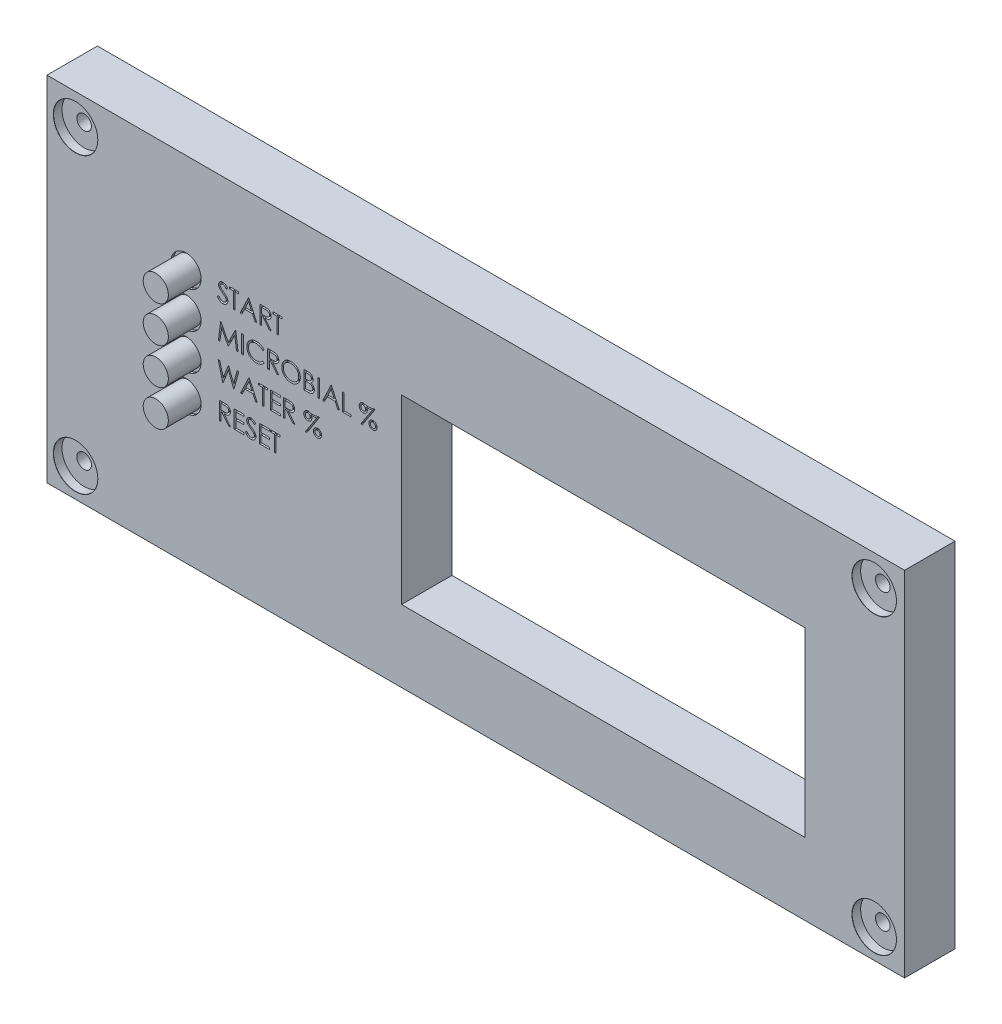
from build123d import *

# Parameters (mm, degrees)
SKETCH1_W                                     = 170
SKETCH1_H                                     = 70
BOSS_EXTRUDE1_DEPTH                           = 10
SKETCH2_W                                     = 80
SKETCH2_H                                     = 36
CUT_EXTRUDE1_DEPTH                            = 10
CBORE_FOR_M2_5_HEX_HEAD_CAP_SCREW1_AT_2_COUNT = 2
CBORE_FOR_M2_5_HEX_HEAD_CAP_SCREW1_AT_2_PITCH = 58.157051492
CBORE_FOR_M2_5_HEX_HEAD_CAP_SCREW1_AT_3_COUNT = 2
CBORE_FOR_M2_5_HEX_HEAD_CAP_SCREW1_AT_3_PITCH = 168.660400897
CBORE_FOR_M2_5_HEX_HEAD_CAP_SCREW1_AT_4_COUNT = 2
CBORE_FOR_M2_5_HEX_HEAD_CAP_SCREW1_AT_4_PITCH = 158.31641795
SKETCH5_R                                     = 2.489791345
BOSS_EXTRUDE4_DEPTH                           = 6
CUT_EXTRUDE3_START                            = -0.5
SKETCH5_4_R                                   = 2.989791345
SKETCH5_4_R_2                                 = 2.489791345
CUT_EXTRUDE3_DEPTH                            = 0.5
SKETCH10_W                                    = 0.314102564
SKETCH10_H                                    = 3.5
CUT_EXTRUDE4_DEPTH                            = 1


with BuildPart() as part:
    # Sketch1 → Boss-Extrude1 (new body)
    with BuildSketch(Plane.XY):
        Rectangle(SKETCH1_W, SKETCH1_H)
    extrude(amount=BOSS_EXTRUDE1_DEPTH)

    # Sketch2 → Cut-Extrude1 (cut)
    with BuildSketch(Plane.XY.offset(10)):
        with Locations((25.281240055, -2.742748837)):
            Rectangle(SKETCH2_W, SKETCH2_H)
    extrude(amount=-CUT_EXTRUDE1_DEPTH, mode=Mode.SUBTRACT)

    # Sketch4 → CBORE for M2.5 Hex Head Cap Screw1 (revolve, cut)
    with BuildSketch(Plane(origin=(-79.337706047, 28.899028673, 10), x_dir=(0, -1, 0), z_dir=(1, 0, 0))):
        Polygon((0, 0), (0, 10), (1.45, 10), (1.45, 1.7), (4.387, 1.7), (4.387, 0.025), (4.412, 0), align=None)
    cbore_for_m2_5_hex_head_cap_screw1 = revolve(axis=Axis((-79.337706047, 28.899028673, 16.35), (0, 0, -1)), mode=Mode.SUBTRACT)

    # CBORE for M2.5 Hex Head Cap Screw1 at 2: CBORE for M2.5 Hex Head Cap Screw1 ×2
    with Locations(*[(0, -i * CBORE_FOR_M2_5_HEX_HEAD_CAP_SCREW1_AT_2_PITCH, 0) for i in range(1, CBORE_FOR_M2_5_HEX_HEAD_CAP_SCREW1_AT_2_COUNT)]):
        add(cbore_for_m2_5_hex_head_cap_screw1, mode=Mode.SUBTRACT)

    # CBORE for M2.5 Hex Head Cap Screw1 at 3: CBORE for M2.5 Hex Head Cap Screw1 ×2
    with Locations(*[Vector(0.9386697595167284, -0.3448174626796145, 0) * (i * CBORE_FOR_M2_5_HEX_HEAD_CAP_SCREW1_AT_3_PITCH) for i in range(1, CBORE_FOR_M2_5_HEX_HEAD_CAP_SCREW1_AT_3_COUNT)]):
        add(cbore_for_m2_5_hex_head_cap_screw1, mode=Mode.SUBTRACT)

    # CBORE for M2.5 Hex Head Cap Screw1 at 4: CBORE for M2.5 Hex Head Cap Screw1 ×2
    with Locations(*[(i * CBORE_FOR_M2_5_HEX_HEAD_CAP_SCREW1_AT_4_PITCH, 0, 0) for i in range(1, CBORE_FOR_M2_5_HEX_HEAD_CAP_SCREW1_AT_4_COUNT)]):
        add(cbore_for_m2_5_hex_head_cap_screw1, mode=Mode.SUBTRACT)

    # Sketch5 → Boss-Extrude4 (add)
    with BuildSketch(Plane.XY.offset(10)):
        with Locations(Location((-57.434570633, -6.282311283, 0), (0, 0, 180))):
            Circle(SKETCH5_R)
        with Locations(Location((-57.434570633, 0.907688717, 0), (0, 0, 180))):
            Circle(SKETCH5_R)
        with Locations(Location((-57.434570633, 8.10041927, 0), (0, 0, 180))):
            Circle(SKETCH5_R)
        with Locations(Location((-57.434570633, 15.290257548, 0), (0, 0, 180))):
            Circle(SKETCH5_R)
    extrude(amount=BOSS_EXTRUDE4_DEPTH)

    # Sketch5<4> → Cut-Extrude3 (cut)
    # profile 1 of 4: a face of its own
    with BuildSketch(Plane.XY.offset(10).offset(CUT_EXTRUDE3_START)):
        with Locations((-57.434570633, 0.907688717)):
            Circle(SKETCH5_4_R)
        with Locations((-57.434570633, 0.907688717)):
            Circle(SKETCH5_4_R_2, mode=Mode.SUBTRACT)
    # profile 2 of 4: a face of its own
    with BuildSketch(Plane.XY.offset(10).offset(CUT_EXTRUDE3_START)):
        with Locations((-57.434570633, 8.10041927)):
            Circle(SKETCH5_4_R)
        with Locations((-57.434570633, 8.10041927)):
            Circle(SKETCH5_4_R_2, mode=Mode.SUBTRACT)
    # profile 3 of 4: a face of its own
    with BuildSketch(Plane.XY.offset(10).offset(CUT_EXTRUDE3_START)):
        with Locations((-57.434570633, -6.282311283)):
            Circle(SKETCH5_4_R)
        with Locations((-57.434570633, -6.282311283)):
            Circle(SKETCH5_4_R_2, mode=Mode.SUBTRACT)
    # profile 4 of 4: a face of its own
    with BuildSketch(Plane.XY.offset(10).offset(CUT_EXTRUDE3_START)):
        with Locations((-57.434570633, 15.290257548)):
            Circle(SKETCH5_4_R)
        with Locations((-57.434570633, 15.290257548)):
            Circle(SKETCH5_4_R_2, mode=Mode.SUBTRACT)
    extrude(amount=CUT_EXTRUDE3_DEPTH, mode=Mode.SUBTRACT)

    # Sketch10 → Cut-Extrude4 (cut)
    # profile 1 of 28: a face of its own
    with BuildSketch(Plane.XY.offset(10)):
        with BuildLine():
            Line((-51.205000821, 13.95685518), (-50.909127423, 14.134238995))
            add(Edge.make_bspline(
                [(-50.909127423, 14.134238995), (-50.881609186, 14.08817461), (-50.828885305, 13.999917026), (-50.740933946, 13.880658985), (-50.649801035, 13.779296828), (-50.554811701, 13.696420221), (-50.456545753, 13.631171334), (-50.354361699, 13.584969102), (-50.248603889, 13.556153127), (-50.176630067, 13.552653041), (-50.140697936, 13.550905661)],
                knots=[0, 0, 0, 0, 1.272034388, 2.437168799, 3.508375237, 4.49857839, 5.41946034, 6.295179144, 7.148887113, 8, 8, 8, 8], degree=3))
            add(Edge.make_bspline(
                [(-50.140697936, 13.550905661), (-50.110011075, 13.551760334), (-50.049174302, 13.553454724), (-49.959612059, 13.569735526), (-49.872630257, 13.594747655), (-49.790021619, 13.630568586), (-49.712926005, 13.673907072), (-49.64531931, 13.72625325), (-49.586873196, 13.784859455), (-49.539064082, 13.85024211), (-49.502384046, 13.920559259), (-49.474191978, 13.99273521), (-49.458546904, 14.067903778), (-49.456190151, 14.118514241), (-49.455000821, 14.1440547)],
                knots=[0, 0, 0, 0, 1.095163259, 2.171163733, 3.241058638, 4.321873601, 5.38011039, 6.391990106, 7.366004449, 8.327778327, 9.272591725, 10.192022065, 11.087607919, 12, 12, 12, 12], degree=3))
            add(Edge.make_bspline(
                [(-49.455000821, 14.1440547), (-49.456475131, 14.173195549), (-49.459472189, 14.232434638), (-49.48480367, 14.319834291), (-49.524652916, 14.406326861), (-49.56141556, 14.459828127), (-49.580501622, 14.487604379)],
                knots=[0, 0, 0, 0, 0.938893495, 1.908633276, 2.914225137, 4, 4, 4, 4], degree=3))
            add(Edge.make_bspline(
                [(-49.580501622, 14.487604379), (-49.596172236, 14.507651203), (-49.62907073, 14.549737001), (-49.685628243, 14.612382237), (-49.751994357, 14.677000656), (-49.825897912, 14.746059713), (-49.910031001, 14.816347509), (-50.001758515, 14.891215787), (-50.103422374, 14.967817364), (-50.174721871, 15.01918993), (-50.211511237, 15.045697328)],
                knots=[0, 0, 0, 0, 0.722233717, 1.516239348, 2.393582979, 3.351407094, 4.387010283, 5.505090956, 6.712668013, 8, 8, 8, 8], degree=3))
            add(Edge.make_bspline(
                [(-50.211511237, 15.045697328), (-50.248335233, 15.071925915), (-50.31873991, 15.122072978), (-50.417198492, 15.196497262), (-50.505242955, 15.264541131), (-50.582481972, 15.326845143), (-50.648881569, 15.383417748), (-50.70496498, 15.433715687), (-50.749303537, 15.479099248), (-50.773959117, 15.50854059), (-50.785028865, 15.521759027)],
                knots=[0, 0, 0, 0, 1.452282411, 2.77665338, 3.964542531, 5.026858415, 5.96415736, 6.766646006, 7.446254459, 8, 8, 8, 8], degree=3))
            add(Edge.make_bspline(
                [(-50.785028865, 15.521759027), (-50.800501411, 15.542360063), (-50.830930247, 15.582874767), (-50.871096253, 15.646199625), (-50.905235416, 15.71102289), (-50.931997748, 15.777518755), (-50.954533967, 15.844753684), (-50.969691897, 15.91360493), (-50.979183294, 15.983763548), (-50.980155281, 16.030977049), (-50.980641846, 16.054611591)],
                knots=[0, 0, 0, 0, 1.068054152, 2.10047183, 3.106115577, 4.101338837, 5.06977816, 6.043150881, 7.020423561, 8, 8, 8, 8], degree=3))
            add(Edge.make_bspline(
                [(-50.980641846, 16.054611591), (-50.979336637, 16.091641365), (-50.976754117, 16.164909429), (-50.9549136, 16.271940259), (-50.920440706, 16.374126677), (-50.872145818, 16.47045701), (-50.809888465, 16.558422991), (-50.737842491, 16.639036478), (-50.652031005, 16.70680506), (-50.557878382, 16.766017119), (-50.454822009, 16.812363044), (-50.346831106, 16.847324024), (-50.233734034, 16.867133282), (-50.157130899, 16.869976047), (-50.118262038, 16.871418482)],
                knots=[0, 0, 0, 0, 1.005424448, 1.989358655, 2.955360095, 3.929531133, 4.905563448, 5.876582895, 6.856512386, 7.866279853, 8.892233794, 9.918561126, 10.94386622, 12, 12, 12, 12], degree=3))
            add(Edge.make_bspline(
                [(-50.118262038, 16.871418482), (-50.077017938, 16.86999593), (-49.994996586, 16.867166929), (-49.874347371, 16.842569398), (-49.758186654, 16.801868726), (-49.66474339, 16.755680068), (-49.591610628, 16.709548652), (-49.535837895, 16.667528828), (-49.479320445, 16.619153719), (-49.42160239, 16.564294473), (-49.36366173, 16.502447722), (-49.304638278, 16.434037033), (-49.244394009, 16.359480477), (-49.205638149, 16.306255977), (-49.185770051, 16.278970565)],
                knots=[0, 0, 0, 0, 1.286793592, 2.559021753, 3.825965368, 5.121522368, 5.803751409, 6.523245864, 7.299691795, 8.125521123, 9.008227632, 9.944561021, 10.946284179, 12, 12, 12, 12], degree=3))
            Line((-49.185770051, 16.278970565), (-49.469724378, 16.063726174))
            add(Edge.make_bspline(
                [(-49.469724378, 16.063726174), (-49.486870311, 16.085814864), (-49.519889368, 16.128352518), (-49.570018855, 16.187923833), (-49.617267503, 16.242340313), (-49.663817902, 16.289605441), (-49.707211534, 16.332307574), (-49.749328576, 16.368867331), (-49.789562927, 16.399642926), (-49.840279838, 16.432486486), (-49.903997556, 16.46504299), (-49.983982092, 16.492592068), (-50.067568368, 16.50914713), (-50.124497999, 16.511336017), (-50.153318128, 16.512444123)],
                knots=[0, 0, 0, 0, 1.181633172, 2.275549214, 3.290209073, 4.226197932, 5.078386478, 5.862611352, 6.581680152, 7.217281963, 8.414376989, 9.595101626, 10.782541182, 12, 12, 12, 12], degree=3))
            add(Edge.make_bspline(
                [(-50.153318128, 16.512444123), (-50.189474651, 16.511232423), (-50.259199098, 16.508895774), (-50.358189334, 16.483375788), (-50.447283259, 16.443193928), (-50.523835824, 16.38687895), (-50.587572801, 16.320157957), (-50.63367826, 16.243379102), (-50.661428425, 16.158596699), (-50.664814704, 16.099455043), (-50.666539282, 16.069335148)],
                knots=[0, 0, 0, 0, 1.14458467, 2.207223713, 3.21896685, 4.227309161, 5.202851033, 6.127160689, 7.046193047, 8, 8, 8, 8], degree=3))
            add(Edge.make_bspline(
                [(-50.666539282, 16.069335148), (-50.666146155, 16.05058367), (-50.665359259, 16.01305005), (-50.654384462, 15.957598628), (-50.640285133, 15.902287289), (-50.617942501, 15.847364706), (-50.587097197, 15.791870347), (-50.546592021, 15.73484861), (-50.495578709, 15.675796901), (-50.456501697, 15.637389527), (-50.435870212, 15.617111591)],
                knots=[0, 0, 0, 0, 0.858281714, 1.717966888, 2.583508476, 3.4729293, 4.427298488, 5.488583878, 6.674047936, 8, 8, 8, 8], degree=3))
            add(Edge.make_bspline(
                [(-50.435870212, 15.617111591), (-50.428208839, 15.610274565), (-50.410007172, 15.594031357), (-50.376731246, 15.567439076), (-50.332788448, 15.534636304), (-50.279326247, 15.494048987), (-50.215358885, 15.446967525), (-50.140879329, 15.393993913), (-50.056717796, 15.333408454), (-49.99699588, 15.291050913), (-49.965417487, 15.268654059)],
                knots=[0, 0, 0, 0, 0.420754252, 0.999615792, 1.744751191, 2.668019286, 3.750313428, 4.999500688, 6.413464383, 8, 8, 8, 8], degree=3))
            add(Edge.make_bspline(
                [(-49.965417487, 15.268654059), (-49.927431574, 15.241012699), (-49.853877118, 15.187489037), (-49.749219538, 15.107073357), (-49.654325729, 15.028425589), (-49.568862526, 14.952047982), (-49.491985617, 14.878519889), (-49.424547897, 14.806956708), (-49.365862216, 14.737871136), (-49.302682998, 14.64929856), (-49.238125178, 14.540517476), (-49.182683671, 14.407239237), (-49.147725324, 14.273442917), (-49.143153808, 14.18351608), (-49.140898256, 14.139146847)],
                knots=[0, 0, 0, 0, 1.163667725, 2.253281268, 3.268753668, 4.215851969, 5.092017293, 5.902905408, 6.650798638, 7.335211899, 8.59617414, 9.77448103, 10.901945474, 12, 12, 12, 12], degree=3))
            add(Edge.make_bspline(
                [(-49.140898256, 14.139146847), (-49.141555395, 14.107768482), (-49.14285691, 14.045621098), (-49.157817823, 13.954366022), (-49.179737489, 13.865735152), (-49.212774723, 13.780824039), (-49.253097881, 13.698079277), (-49.304264129, 13.619671376), (-49.363571813, 13.543864978), (-49.431605578, 13.472681486), (-49.506051481, 13.40733529), (-49.584735175, 13.349206229), (-49.667785448, 13.300737906), (-49.754751765, 13.261187063), (-49.845654102, 13.230253546), (-49.940461885, 13.207840677), (-50.039331397, 13.194084966), (-50.106531878, 13.192657204), (-50.140697936, 13.191931302)],
                knots=[0, 0, 0, 0, 0.983748083, 1.948392443, 2.894712957, 3.844097841, 4.80183111, 5.778335162, 6.776009319, 7.81870978, 8.863265674, 9.881300176, 10.883814829, 11.87499822, 12.874611388, 13.892143829, 14.928324115, 16, 16, 16, 16], degree=3))
            add(Edge.make_bspline(
                [(-50.140697936, 13.191931302), (-50.167133279, 13.192442484), (-50.219671039, 13.193458409), (-50.297380521, 13.20243969), (-50.37352011, 13.215146793), (-50.447134392, 13.235320863), (-50.519171804, 13.25979784), (-50.589319038, 13.289936173), (-50.657610092, 13.326053374), (-50.724427675, 13.367348399), (-50.78960185, 13.415406143), (-50.852521317, 13.47137964), (-50.915250503, 13.533725145), (-50.975937899, 13.604135708), (-51.035811044, 13.681473791), (-51.093689453, 13.766462975), (-51.150771171, 13.858640328), (-51.186586639, 13.923505414), (-51.205000821, 13.95685518)],
                knots=[0, 0, 0, 0, 0.915332311, 1.819136955, 2.706846663, 3.586547465, 4.459518054, 5.340707479, 6.227863349, 7.133153174, 8.059268498, 9.028702269, 10.047606654, 11.120612155, 12.245963614, 13.433783089, 14.680604001, 16, 16, 16, 16], degree=3))
        make_face()
    # profile 2 of 28: a face of its own
    with BuildSketch(Plane.XY.offset(10)):
        Polygon((-48.826795692, 16.422700533), (-48.826795692, 16.781674892), (-46.987052103, 16.781674892), (-46.987052103, 16.422700533), (-47.749872615, 16.422700533), (-47.749872615, 13.281674892), (-48.063975179, 13.281674892), (-48.063975179, 16.422700533), align=None)
    # profile 3 of 28: a face of its own
    with BuildSketch(Plane.XY.offset(10)):
        Polygon((-45.012693128, 16.781674892), (-43.397308513, 13.281674892), (-43.738754827, 13.281674892), (-44.256182712, 14.403469764), (-45.842821333, 14.403469764), (-46.374271654, 13.281674892), (-46.717821333, 13.281674892), (-45.057564923, 16.781674892), align=None)
        Polygon((-45.038634635, 16.098782264), (-45.671747615, 14.762444123), (-44.421647455, 14.762444123), align=None, mode=Mode.SUBTRACT)
    # profile 4 of 28: a face of its own
    with BuildSketch(Plane.XY.offset(10)):
        with BuildLine():
            Line((-42.769103385, 16.781674892), (-42.068682712, 16.781674892))
            add(Edge.make_bspline(
                [(-42.068682712, 16.781674892), (-42.021941583, 16.781519306), (-41.932193439, 16.781220564), (-41.803620168, 16.779554801), (-41.686793071, 16.774780445), (-41.581773232, 16.770671862), (-41.488562577, 16.76317992), (-41.406875286, 16.756019273), (-41.337087589, 16.746645612), (-41.294841737, 16.737940189), (-41.275713962, 16.73399861)],
                knots=[0, 0, 0, 0, 1.410062039, 2.707475311, 3.878576406, 4.937260626, 5.877586885, 6.699081471, 7.410979367, 8, 8, 8, 8], degree=3))
            add(Edge.make_bspline(
                [(-41.275713962, 16.73399861), (-41.250107337, 16.727671845), (-41.199440348, 16.715153281), (-41.126490282, 16.68869368), (-41.056975958, 16.658074055), (-40.991186134, 16.622110335), (-40.929450342, 16.580535555), (-40.871132032, 16.534067433), (-40.815966568, 16.482960227), (-40.766184938, 16.425925386), (-40.719245886, 16.366088876), (-40.67965726, 16.301385119), (-40.64553078, 16.233723592), (-40.618360263, 16.162416174), (-40.59648229, 16.088154402), (-40.58105605, 16.010265605), (-40.571804863, 15.92910463), (-40.570863007, 15.873746721), (-40.570385436, 15.845677296)],
                knots=[0, 0, 0, 0, 1.027469482, 2.033020251, 3.019912614, 3.986113645, 4.951240523, 5.91722682, 6.890402269, 7.87763091, 8.8651537, 9.85103654, 10.82876324, 11.815024772, 12.821070561, 13.842952187, 14.906261191, 16, 16, 16, 16], degree=3))
            add(Edge.make_bspline(
                [(-40.570385436, 15.845677296), (-40.571854434, 15.799042191), (-40.57472083, 15.708045023), (-40.601445933, 15.575984142), (-40.645222453, 15.452794827), (-40.705545742, 15.338632189), (-40.782365218, 15.235721544), (-40.874690009, 15.145331089), (-40.982571621, 15.069691176), (-41.083000936, 15.017238371), (-41.171715136, 14.983645463), (-41.244748449, 14.960009104), (-41.324415426, 14.941747139), (-41.409952761, 14.925387007), (-41.501716417, 14.913035312), (-41.599486456, 14.903988718), (-41.703332608, 14.898334669), (-41.774671677, 14.897492664), (-41.811371013, 14.897059507)],
                knots=[0, 0, 0, 0, 1.260483769, 2.459530307, 3.627416485, 4.787058657, 5.939039949, 7.08810263, 8.267026773, 9.491475466, 10.141966685, 10.831826277, 11.566392101, 12.351337768, 13.187381173, 14.07005841, 15.007169909, 16, 16, 16, 16], degree=3))
            Line((-41.811371013, 14.897059507), (-40.525513641, 13.281674892))
            Line((-40.525513641, 13.281674892), (-40.913935115, 13.281674892))
            Line((-40.913935115, 13.281674892), (-42.199792487, 14.897059507))
            Line((-42.199792487, 14.897059507), (-42.455000821, 14.897059507))
            Line((-42.455000821, 14.897059507), (-42.455000821, 13.281674892))
            Line((-42.455000821, 13.281674892), (-42.769103385, 13.281674892))
            Line((-42.769103385, 13.281674892), (-42.769103385, 16.781674892))
        make_face()
        with BuildLine():
            Line((-42.455000821, 16.422700533), (-42.455000821, 15.256033866))
            Line((-42.455000821, 15.256033866), (-41.8141755, 15.251126014))
            add(Edge.make_bspline(
                [(-41.8141755, 15.251126014), (-41.784255461, 15.251112777), (-41.726261904, 15.251087121), (-41.642361239, 15.255080897), (-41.564241127, 15.259624215), (-41.492200375, 15.266573561), (-41.4262068, 15.275529632), (-41.366293387, 15.286732617), (-41.312362335, 15.299784679), (-41.249463796, 15.319986305), (-41.179227265, 15.351992323), (-41.102895805, 15.398557822), (-41.037893467, 15.457126941), (-40.982975605, 15.524100397), (-40.938846174, 15.597736646), (-40.907734119, 15.677153015), (-40.887991677, 15.760344613), (-40.885663132, 15.817522721), (-40.884488, 15.846378418)],
                knots=[0, 0, 0, 0, 1.146690395, 2.22261258, 3.21895312, 4.145990853, 4.996080663, 5.770904154, 6.481378293, 7.121626537, 8.300444488, 9.431385265, 10.535395872, 11.636531494, 12.74115979, 13.810798291, 14.895190096, 16, 16, 16, 16], degree=3))
            add(Edge.make_bspline(
                [(-40.884488, 15.846378418), (-40.885690121, 15.874524991), (-40.888072286, 15.93030123), (-40.907521055, 16.01195714), (-40.940410436, 16.08902409), (-40.984732674, 16.161188575), (-41.038731829, 16.226694311), (-41.102049642, 16.282741464), (-41.172954837, 16.328990929), (-41.239226035, 16.35854531), (-41.298460248, 16.376665163), (-41.349889908, 16.389416327), (-41.408001386, 16.399660795), (-41.473076844, 16.407868856), (-41.544838475, 16.414923801), (-41.623649126, 16.419675579), (-41.708985906, 16.422489443), (-41.768132838, 16.422628532), (-41.798750821, 16.422700533)],
                knots=[0, 0, 0, 0, 1.101028733, 2.181837193, 3.264309656, 4.369019818, 5.486613113, 6.575447106, 7.666700264, 8.788928104, 9.402425223, 10.0903467, 10.862060571, 11.710948788, 12.657782767, 13.684531032, 14.801375019, 16, 16, 16, 16], degree=3))
            Line((-41.798750821, 16.422700533), (-42.455000821, 16.422700533))
        make_face(mode=Mode.SUBTRACT)
    # profile 5 of 28: a face of its own
    with BuildSketch(Plane.XY.offset(10)):
        Polygon((-40.211411077, 16.422700533), (-40.211411077, 16.781674892), (-38.371667487, 16.781674892), (-38.371667487, 16.422700533), (-39.134488, 16.422700533), (-39.134488, 13.281674892), (-39.448590564, 13.281674892), (-39.448590564, 16.422700533), align=None)
    # profile 6 of 28: a face of its own
    with BuildSketch(Plane.XY.offset(10)):
        Polygon((-51.025513641, 6.448341559), (-50.563474378, 9.948341559), (-50.518602583, 9.948341559), (-49.073590564, 7.076546687), (-47.632785276, 9.948341559), (-47.587913481, 9.948341559), (-47.121667487, 6.448341559), (-47.435770051, 6.448341559), (-47.772308513, 8.96466768), (-49.035028865, 6.448341559), (-49.106543288, 6.448341559), (-50.374872615, 8.97238002), (-50.709307712, 6.448341559), align=None)
    # profile 7 of 28: a face of its own
    with BuildSketch(Plane.XY.offset(10)):
        with Locations((-46.246667487, 8.198341559)):
            Rectangle(SKETCH10_W, SKETCH10_H)
    # profile 8 of 28: a face of its own
    with BuildSketch(Plane.XY.offset(10)):
        with BuildLine():
            Line((-41.961411077, 9.306113995), (-42.236250821, 9.095777456))
            add(Edge.make_bspline(
                [(-42.236250821, 9.095777456), (-42.255856709, 9.119143426), (-42.294804156, 9.165560342), (-42.357463358, 9.230739886), (-42.422765001, 9.291805147), (-42.490684122, 9.349047027), (-42.562443242, 9.400463793), (-42.63630404, 9.448734896), (-42.713502086, 9.492002634), (-42.82025382, 9.54446562), (-42.959901669, 9.599211775), (-43.135696508, 9.645115006), (-43.319207606, 9.674336182), (-43.444405206, 9.677501023), (-43.508085756, 9.679110789)],
                knots=[0, 0, 0, 0, 0.757959112, 1.505699292, 2.245454638, 2.979532153, 3.711538275, 4.438200793, 5.171680507, 5.909471876, 7.393775596, 8.890124382, 10.418191784, 12, 12, 12, 12], degree=3))
            add(Edge.make_bspline(
                [(-43.508085756, 9.679110789), (-43.543169056, 9.678706827), (-43.613010048, 9.677902651), (-43.716658522, 9.667293526), (-43.818371573, 9.652382316), (-43.918083039, 9.630256993), (-44.015665998, 9.602284373), (-44.1117584, 9.56885896), (-44.204969, 9.52750412), (-44.296587238, 9.48179586), (-44.384366449, 9.430168415), (-44.467421497, 9.373855063), (-44.545449464, 9.313485967), (-44.618512077, 9.24883486), (-44.686684025, 9.1801929), (-44.749471336, 9.106828558), (-44.806656746, 9.028976385), (-44.859373771, 8.947662977), (-44.906586504, 8.863125185), (-44.946116384, 8.775050115), (-44.981121506, 8.684946012), (-45.008820749, 8.591794851), (-45.030745266, 8.496252085), (-45.045872929, 8.398061297), (-45.0563614, 8.297427618), (-45.057161577, 8.229218305), (-45.057564923, 8.19483595)],
                knots=[0, 0, 0, 0, 1.054917814, 2.100044995, 3.131103042, 4.146048494, 5.169673617, 6.183595914, 7.203665975, 8.234915748, 9.262203917, 10.264457458, 11.251630812, 12.227803204, 13.197192746, 14.159520551, 15.12972552, 16.100847026, 17.073214652, 18.039054194, 19.002613845, 19.979014051, 20.95965708, 21.949030935, 22.966165397, 24, 24, 24, 24], degree=3))
            add(Edge.make_bspline(
                [(-45.057564923, 8.19483595), (-45.056303104, 8.14310463), (-45.05382569, 8.041537045), (-45.031777356, 7.892766434), (-44.998272264, 7.750245761), (-44.948056687, 7.614865918), (-44.886137637, 7.48495756), (-44.807897025, 7.362718707), (-44.717280488, 7.246302142), (-44.613006069, 7.138459195), (-44.498600253, 7.039945469), (-44.375852341, 6.953194888), (-44.245068053, 6.880880005), (-44.107691423, 6.820704059), (-43.962665309, 6.774447331), (-43.810250507, 6.741883208), (-43.650778511, 6.720641027), (-43.541809112, 6.718607339), (-43.486350981, 6.717572328)],
                knots=[0, 0, 0, 0, 1.029171465, 2.020641659, 2.987623507, 3.938342917, 4.889210282, 5.84687017, 6.821220943, 7.821438502, 8.827599549, 9.822697543, 10.807740252, 11.797342354, 12.80366471, 13.83203677, 14.896651826, 16, 16, 16, 16], degree=3))
            add(Edge.make_bspline(
                [(-43.486350981, 6.717572328), (-43.425248292, 6.719261108), (-43.304983583, 6.72258503), (-43.128615557, 6.750744279), (-42.959779791, 6.796402197), (-42.798467204, 6.860300119), (-42.645132558, 6.943365407), (-42.499535898, 7.044063285), (-42.361554327, 7.163351617), (-42.278583045, 7.254434746), (-42.236250821, 7.300905661)],
                knots=[0, 0, 0, 0, 1.028121516, 2.023589091, 2.998037872, 3.967518031, 4.937445131, 5.927275754, 6.942489185, 8, 8, 8, 8], degree=3))
            Line((-42.236250821, 7.300905661), (-41.961411077, 7.092672488))
            add(Edge.make_bspline(
                [(-41.961411077, 7.092672488), (-41.983529187, 7.064134036), (-42.027659462, 7.00719383), (-42.099117479, 6.92692212), (-42.174394776, 6.851418085), (-42.254050486, 6.781290463), (-42.337168278, 6.715135998), (-42.42524059, 6.654834167), (-42.517109623, 6.599543282), (-42.612464102, 6.548916358), (-42.711202715, 6.503999111), (-42.81320715, 6.465545343), (-42.918037725, 6.432420453), (-43.025699233, 6.405168517), (-43.13641499, 6.383897433), (-43.249785464, 6.369677758), (-43.36605534, 6.359935844), (-43.444496761, 6.359047928), (-43.484247615, 6.358597969)],
                knots=[0, 0, 0, 0, 0.986787822, 1.968848986, 2.935600012, 3.899624008, 4.868462664, 5.837806735, 6.815139263, 7.798259679, 8.787526145, 9.778297419, 10.776456485, 11.791383307, 12.812564526, 13.85620153, 14.913611965, 16, 16, 16, 16], degree=3))
            add(Edge.make_bspline(
                [(-43.484247615, 6.358597969), (-43.521891282, 6.358859961), (-43.596326973, 6.359378019), (-43.706225724, 6.367770187), (-43.813215305, 6.379219924), (-43.916989931, 6.396460055), (-44.018115906, 6.416804395), (-44.11567649, 6.444075651), (-44.210631701, 6.474624818), (-44.302600041, 6.510529805), (-44.391659741, 6.551045987), (-44.477523553, 6.596837546), (-44.560151985, 6.647519411), (-44.640357406, 6.701974421), (-44.71695499, 6.761951723), (-44.790608515, 6.826618358), (-44.861730991, 6.895756368), (-44.905733676, 6.945611222), (-44.927857391, 6.970677296)],
                knots=[0, 0, 0, 0, 1.114604814, 2.203992996, 3.262667896, 4.300477797, 5.318619304, 6.316056647, 7.298880507, 8.271930387, 9.238335007, 10.195173496, 11.151986948, 12.108099108, 13.064862484, 14.031167946, 15.010108607, 16, 16, 16, 16], degree=3))
            add(Edge.make_bspline(
                [(-44.927857391, 6.970677296), (-44.963293035, 7.014218485), (-45.033736511, 7.100775195), (-45.123862195, 7.241061176), (-45.20100975, 7.387529385), (-45.263385671, 7.540949314), (-45.312148404, 7.700976701), (-45.345929599, 7.867692216), (-45.367881204, 8.040940158), (-45.370391492, 8.158776947), (-45.371667487, 8.218674091)],
                knots=[0, 0, 0, 0, 0.994628077, 1.977248131, 2.950237994, 3.925870899, 4.908910175, 5.911660606, 6.938484602, 8, 8, 8, 8], degree=3))
            add(Edge.make_bspline(
                [(-45.371667487, 8.218674091), (-45.370112294, 8.281629544), (-45.367052547, 8.405490469), (-45.341056752, 8.587264422), (-45.299237956, 8.761415821), (-45.239841067, 8.927619565), (-45.164535716, 9.086749846), (-45.071509102, 9.237591051), (-44.96184196, 9.38110785), (-44.836394392, 9.515122602), (-44.698827057, 9.637661954), (-44.551508243, 9.745468158), (-44.394726296, 9.835185674), (-44.230208444, 9.910181836), (-44.056722763, 9.967826299), (-43.874639394, 10.008179486), (-43.684300479, 10.033296602), (-43.554438053, 10.03647181), (-43.488454346, 10.038085148)],
                knots=[0, 0, 0, 0, 1.032925535, 2.032216505, 3.007276963, 3.968222605, 4.92396291, 5.891752235, 6.871517503, 7.883894988, 8.900124299, 9.891468569, 10.874487609, 11.85992873, 12.854644235, 13.869047385, 14.917252991, 16, 16, 16, 16], degree=3))
            add(Edge.make_bspline(
                [(-43.488454346, 10.038085148), (-43.448239874, 10.03760301), (-43.368639377, 10.036648666), (-43.250886725, 10.027342524), (-43.136244398, 10.011828918), (-43.024633416, 9.990712848), (-42.915510799, 9.964505527), (-42.809710558, 9.930365228), (-42.706611872, 9.891328697), (-42.606864963, 9.846370231), (-42.510948413, 9.79590349), (-42.418892095, 9.740487866), (-42.331427236, 9.680192061), (-42.247938388, 9.615528885), (-42.169822177, 9.545130326), (-42.094860698, 9.47093273), (-42.02559962, 9.390798906), (-41.982846425, 9.334393972), (-41.961411077, 9.306113995)],
                knots=[0, 0, 0, 0, 1.096760587, 2.17092713, 3.219439832, 4.250915756, 5.268269357, 6.278326846, 7.281116186, 8.274029601, 9.260640565, 10.235837813, 11.203064059, 12.156899882, 13.114053108, 14.069676657, 15.032185724, 16, 16, 16, 16], degree=3))
        make_face()
    # profile 9 of 28: a face of its own
    with BuildSketch(Plane.XY.offset(10)):
        with BuildLine():
            Line((-41.243462359, 9.948341559), (-40.543041686, 9.948341559))
            add(Edge.make_bspline(
                [(-40.543041686, 9.948341559), (-40.496300557, 9.948185973), (-40.406552413, 9.94788723), (-40.277979143, 9.946221467), (-40.161152046, 9.941447112), (-40.056132206, 9.937338528), (-39.962921551, 9.929846587), (-39.881234261, 9.92268594), (-39.811446563, 9.913312279), (-39.769200712, 9.904606856), (-39.750072936, 9.900665277)],
                knots=[0, 0, 0, 0, 1.410062039, 2.707475311, 3.878576406, 4.937260626, 5.877586885, 6.699081471, 7.410979367, 8, 8, 8, 8], degree=3))
            add(Edge.make_bspline(
                [(-39.750072936, 9.900665277), (-39.724466312, 9.894338511), (-39.673799322, 9.881819948), (-39.600849256, 9.855360347), (-39.531334932, 9.824740722), (-39.465545108, 9.788777002), (-39.403809317, 9.747202222), (-39.345491006, 9.7007341), (-39.290325543, 9.649626894), (-39.240543912, 9.592592052), (-39.193604861, 9.532755543), (-39.154016234, 9.468051786), (-39.119889755, 9.400390258), (-39.092719238, 9.329082841), (-39.070841264, 9.254821069), (-39.055415025, 9.176932272), (-39.046163837, 9.095771297), (-39.045221981, 9.040413388), (-39.04474441, 9.012343962)],
                knots=[0, 0, 0, 0, 1.027469482, 2.033020251, 3.019912614, 3.986113645, 4.951240523, 5.91722682, 6.890402269, 7.87763091, 8.8651537, 9.85103654, 10.82876324, 11.815024772, 12.821070561, 13.842952187, 14.906261191, 16, 16, 16, 16], degree=3))
            add(Edge.make_bspline(
                [(-39.04474441, 9.012343962), (-39.046213408, 8.965708858), (-39.049079804, 8.87471169), (-39.075804908, 8.742650809), (-39.119581428, 8.619461494), (-39.179904717, 8.505298856), (-39.256724192, 8.402388211), (-39.349048983, 8.311997755), (-39.456930595, 8.236357843), (-39.557359911, 8.183905038), (-39.646074111, 8.150312129), (-39.719107423, 8.126675771), (-39.798774401, 8.108413805), (-39.884311735, 8.092053674), (-39.976075391, 8.079701979), (-40.07384543, 8.070655385), (-40.177691582, 8.065001336), (-40.249030651, 8.064159331), (-40.285729987, 8.063726174)],
                knots=[0, 0, 0, 0, 1.260483769, 2.459530307, 3.627416485, 4.787058657, 5.939039949, 7.08810263, 8.267026773, 9.491475466, 10.141966685, 10.831826277, 11.566392101, 12.351337768, 13.187381173, 14.07005841, 15.007169909, 16, 16, 16, 16], degree=3))
            Line((-40.285729987, 8.063726174), (-38.999872615, 6.448341559))
            Line((-38.999872615, 6.448341559), (-39.38829409, 6.448341559))
            Line((-39.38829409, 6.448341559), (-40.674151462, 8.063726174))
            Line((-40.674151462, 8.063726174), (-40.929359795, 8.063726174))
            Line((-40.929359795, 8.063726174), (-40.929359795, 6.448341559))
            Line((-40.929359795, 6.448341559), (-41.243462359, 6.448341559))
            Line((-41.243462359, 6.448341559), (-41.243462359, 9.948341559))
        make_face()
        with BuildLine():
            Line((-40.929359795, 9.5893672), (-40.929359795, 8.422700533))
            Line((-40.929359795, 8.422700533), (-40.288534474, 8.41779268))
            add(Edge.make_bspline(
                [(-40.288534474, 8.41779268), (-40.258614435, 8.417779444), (-40.200620878, 8.417753787), (-40.116720214, 8.421747564), (-40.038600102, 8.426290882), (-39.96655935, 8.433240227), (-39.900565774, 8.442196299), (-39.840652361, 8.453399283), (-39.786721309, 8.466451346), (-39.723822771, 8.486652972), (-39.653586239, 8.51865899), (-39.57725478, 8.565224489), (-39.512252442, 8.623793608), (-39.45733458, 8.690767064), (-39.413205148, 8.764403313), (-39.382093094, 8.843819682), (-39.362350651, 8.92701128), (-39.360022106, 8.984189388), (-39.358846974, 9.013045084)],
                knots=[0, 0, 0, 0, 1.146690395, 2.22261258, 3.21895312, 4.145990853, 4.996080663, 5.770904154, 6.481378293, 7.121626537, 8.300444488, 9.431385265, 10.535395872, 11.636531494, 12.74115979, 13.810798291, 14.895190096, 16, 16, 16, 16], degree=3))
            add(Edge.make_bspline(
                [(-39.358846974, 9.013045084), (-39.360049095, 9.041191658), (-39.362431261, 9.096967897), (-39.381880029, 9.178623807), (-39.414769411, 9.255690757), (-39.459091649, 9.327855242), (-39.513090804, 9.393360978), (-39.576408616, 9.449408131), (-39.647313811, 9.495657596), (-39.71358501, 9.525211976), (-39.772819222, 9.543331829), (-39.824248882, 9.556082993), (-39.88236036, 9.566327462), (-39.947435819, 9.574535523), (-40.019197449, 9.581590467), (-40.098008101, 9.586342246), (-40.183344881, 9.58915611), (-40.242491812, 9.589295199), (-40.273109795, 9.5893672)],
                knots=[0, 0, 0, 0, 1.101028733, 2.181837193, 3.264309656, 4.369019818, 5.486613113, 6.575447106, 7.666700264, 8.788928104, 9.402425223, 10.0903467, 10.862060571, 11.710948788, 12.657782767, 13.684531032, 14.801375019, 16, 16, 16, 16], degree=3))
            Line((-40.273109795, 9.5893672), (-40.929359795, 9.5893672))
        make_face(mode=Mode.SUBTRACT)
    # profile 10 of 28: a face of its own
    with BuildSketch(Plane.XY.offset(10)):
        with BuildLine():
            add(Edge.make_bspline(
                [(-36.644103385, 10.038085148), (-36.579295279, 10.036443669), (-36.452006812, 10.033219668), (-36.264931914, 10.008540565), (-36.086336819, 9.965845175), (-35.91476668, 9.908982192), (-35.752273703, 9.833127807), (-35.597634811, 9.741442658), (-35.451217937, 9.6329662), (-35.314996556, 9.508536973), (-35.190339605, 9.373153519), (-35.080513719, 9.228675609), (-34.988471425, 9.075976806), (-34.912885638, 8.915515976), (-34.853587028, 8.747656008), (-34.812667985, 8.571502005), (-34.786529835, 8.388195315), (-34.783474057, 8.26316845), (-34.781923897, 8.199743802)],
                knots=[0, 0, 0, 0, 1.065120563, 2.091984664, 3.0946048, 4.079830382, 5.057816894, 6.036188127, 7.030412546, 8.04752943, 9.064399622, 10.05169764, 11.02544977, 11.989514704, 12.962713494, 13.945757189, 14.957906945, 16, 16, 16, 16], degree=3))
            add(Edge.make_bspline(
                [(-34.781923897, 8.199743802), (-34.78347383, 8.136786356), (-34.786528927, 8.012689935), (-34.812697704, 7.830546491), (-34.853738704, 7.655455795), (-34.91233497, 7.487710142), (-34.987560449, 7.327132578), (-35.08021562, 7.174145624), (-35.189356831, 7.028699126), (-35.313563682, 6.892386461), (-35.448964724, 6.76738899), (-35.59419499, 6.658470114), (-35.74598831, 6.56474599), (-35.906298018, 6.489962316), (-36.072998055, 6.430190395), (-36.247580378, 6.389437765), (-36.429226932, 6.363150722), (-36.553097936, 6.360132206), (-36.616058513, 6.358597969)],
                knots=[0, 0, 0, 0, 1.043624062, 2.057103931, 3.04512605, 4.022047818, 4.998200453, 5.980619268, 6.982898556, 8.009068085, 9.034988726, 10.034168286, 11.015286542, 11.987931943, 12.962482838, 13.94673481, 14.956375938, 16, 16, 16, 16], degree=3))
            add(Edge.make_bspline(
                [(-36.616058513, 6.358597969), (-36.679482832, 6.360147356), (-36.804509048, 6.36320161), (-36.988046083, 6.389383014), (-37.164323827, 6.430324318), (-37.332838178, 6.488833754), (-37.493683108, 6.564450985), (-37.64717319, 6.656655364), (-37.792692338, 6.766062505), (-37.929034084, 6.89022908), (-38.053783282, 7.025400632), (-38.162542658, 7.170234887), (-38.254767771, 7.321890344), (-38.330131104, 7.480787868), (-38.389795563, 7.646159311), (-38.430500381, 7.819107788), (-38.456836333, 7.998647294), (-38.45987118, 8.120890192), (-38.461411077, 8.182916879)],
                knots=[0, 0, 0, 0, 1.053102029, 2.075944431, 3.073151272, 4.055350789, 5.033113405, 6.020478099, 7.024410459, 8.052272461, 9.079885166, 10.07527673, 11.055994387, 12.023226415, 12.992069828, 13.970394897, 14.97016774, 16, 16, 16, 16], degree=3))
            add(Edge.make_bspline(
                [(-38.461411077, 8.182916879), (-38.460876441, 8.224549548), (-38.459813915, 8.307289672), (-38.447022223, 8.430156272), (-38.428460521, 8.55104693), (-38.401858609, 8.669617878), (-38.367066942, 8.785578862), (-38.326014914, 8.899729625), (-38.275875069, 9.010913349), (-38.219194421, 9.119656741), (-38.155932613, 9.224264646), (-38.086056864, 9.32314423), (-38.012021495, 9.417125226), (-37.930858102, 9.50377223), (-37.845241656, 9.585605887), (-37.753783278, 9.661368604), (-37.657041034, 9.731743555), (-37.554598654, 9.795163896), (-37.448980379, 9.85252303), (-37.340103601, 9.901744881), (-37.22944703, 9.943990943), (-37.116492382, 9.978231768), (-37.00153961, 10.005263804), (-36.884337825, 10.023671158), (-36.764980399, 10.036495476), (-36.68456908, 10.037552978), (-36.644103385, 10.038085148)],
                knots=[0, 0, 0, 0, 1.037015668, 2.060948919, 3.074880161, 4.083647147, 5.086022904, 6.090072063, 7.104153813, 8.122640571, 9.144368836, 10.147691507, 11.138137339, 12.123020368, 13.103399296, 14.087645067, 15.080126199, 16.082011238, 17.087798457, 18.072939717, 19.057185487, 20.037253025, 21.01195951, 21.997135196, 22.992090687, 24, 24, 24, 24], degree=3))
        make_face()
        with BuildLine():
            add(Edge.make_bspline(
                [(-36.628678705, 9.679110789), (-36.661893339, 9.678705899), (-36.728005072, 9.677899989), (-36.826289608, 9.667284274), (-36.923281542, 9.652154385), (-37.019000904, 9.630572864), (-37.113047193, 9.601168811), (-37.206297034, 9.567327903), (-37.297900088, 9.526106813), (-37.387553946, 9.479534108), (-37.474469021, 9.427985187), (-37.556481723, 9.37101342), (-37.633804367, 9.309954866), (-37.706247633, 9.244667029), (-37.773598806, 9.174817427), (-37.837183507, 9.101464991), (-37.894453089, 9.0225131), (-37.946938665, 8.940102693), (-37.993906506, 8.854341112), (-38.03567186, 8.766131249), (-38.069835869, 8.674753563), (-38.097698246, 8.581199405), (-38.120798056, 8.485616945), (-38.13543198, 8.387281097), (-38.14616434, 8.286685985), (-38.146924185, 8.21870413), (-38.147308513, 8.184319123)],
                knots=[0, 0, 0, 0, 1.008559885, 2.007477868, 2.99961109, 3.989939068, 4.984837346, 5.991145699, 7.001802488, 8.033829008, 9.059044045, 10.069351652, 11.065060232, 12.050310815, 13.029377138, 14.011219647, 14.996725999, 15.989392538, 16.977580475, 17.965360261, 18.951710183, 19.937753436, 20.929683414, 21.935841486, 22.955955122, 24, 24, 24, 24], degree=3))
            add(Edge.make_bspline(
                [(-38.147308513, 8.184319123), (-38.146033651, 8.133756902), (-38.143525603, 8.034285372), (-38.121568033, 7.888517228), (-38.087746058, 7.748428941), (-38.037888692, 7.614787032), (-37.975538077, 7.486442749), (-37.898511187, 7.364534645), (-37.807252102, 7.24902977), (-37.703588575, 7.140734501), (-37.590265868, 7.041888697), (-37.469933138, 6.955125288), (-37.343879531, 6.881715039), (-37.211776328, 6.821909966), (-37.074328789, 6.774520228), (-36.930651238, 6.742041597), (-36.781700779, 6.720666142), (-36.680170123, 6.718613386), (-36.628678705, 6.717572328)],
                knots=[0, 0, 0, 0, 1.032063989, 2.030389145, 3.003944642, 3.970395727, 4.937377036, 5.913328081, 6.909231446, 7.93887556, 8.970685674, 9.976071282, 10.964166581, 11.944589148, 12.933237628, 13.927779006, 14.949070134, 16, 16, 16, 16], degree=3))
            add(Edge.make_bspline(
                [(-36.628678705, 6.717572328), (-36.594069204, 6.718047832), (-36.525428167, 6.7189909), (-36.423332645, 6.728489577), (-36.323076433, 6.743721446), (-36.224800153, 6.765652102), (-36.128615342, 6.793099308), (-36.034120539, 6.825707036), (-35.942322248, 6.86638824), (-35.852062411, 6.911336192), (-35.765666169, 6.962576349), (-35.683190637, 7.017614499), (-35.606714657, 7.07858312), (-35.534325585, 7.142900932), (-35.466697896, 7.21186478), (-35.404288912, 7.285385002), (-35.34730878, 7.363925659), (-35.294843133, 7.446211065), (-35.248039871, 7.532207318), (-35.207260772, 7.620736995), (-35.172664656, 7.711582105), (-35.144736151, 7.804873676), (-35.122850689, 7.900434525), (-35.107770769, 7.998392603), (-35.097222331, 8.098551946), (-35.096427253, 8.166295802), (-35.096026462, 8.200444924)],
                knots=[0, 0, 0, 0, 1.047197238, 2.076906641, 3.100256066, 4.114471768, 5.12198147, 6.126382909, 7.136867548, 8.15857795, 9.17633901, 10.174870724, 11.156907918, 12.133735059, 13.104061851, 14.077631395, 15.04955518, 16.038496417, 17.029181396, 18.010275684, 18.986308667, 19.968651475, 20.955262928, 21.950658345, 22.966943676, 24, 24, 24, 24], degree=3))
            add(Edge.make_bspline(
                [(-35.096026462, 8.200444924), (-35.096427575, 8.234360428), (-35.097223256, 8.301638078), (-35.107765731, 8.401098897), (-35.122866621, 8.498352108), (-35.144629329, 8.593015911), (-35.172679483, 8.685114436), (-35.207266813, 8.774561184), (-35.248052113, 8.861689379), (-35.294860337, 8.946283676), (-35.34747616, 9.027458414), (-35.404970404, 9.105060827), (-35.468335752, 9.177633568), (-35.535761777, 9.246968262), (-35.608932662, 9.311586152), (-35.687516956, 9.371508672), (-35.770560634, 9.428181947), (-35.858487869, 9.479307508), (-35.949231823, 9.526521741), (-36.042345781, 9.566972744), (-36.136774881, 9.601344864), (-36.232278993, 9.630661829), (-36.329661971, 9.652069859), (-36.4282658, 9.667297909), (-36.527954059, 9.677896295), (-36.594997279, 9.678704673), (-36.628678705, 9.679110789)],
                knots=[0, 0, 0, 0, 1.02996197, 2.043119294, 3.035359645, 4.018872909, 4.991431989, 5.957985074, 6.929999688, 7.912076566, 8.892894881, 9.867085534, 10.843653904, 11.817741046, 12.803660682, 13.806313499, 14.818574707, 15.856120519, 16.894564902, 17.924820532, 18.937903209, 19.946497019, 20.957711757, 21.963978472, 22.977135795, 24, 24, 24, 24], degree=3))
        make_face(mode=Mode.SUBTRACT)
    # profile 11 of 28: a face of its own
    with BuildSketch(Plane.XY.offset(10)):
        with BuildLine():
            Line((-34.063975179, 9.948341559), (-33.381082551, 9.948341559))
            add(Edge.make_bspline(
                [(-33.381082551, 9.948341559), (-33.347654073, 9.948165808), (-33.282861363, 9.94782516), (-33.188641921, 9.942542029), (-33.10039311, 9.935338359), (-33.018089338, 9.923908267), (-32.941768636, 9.910116489), (-32.871200998, 9.893414673), (-32.806610826, 9.87338806), (-32.72949809, 9.841541778), (-32.641577429, 9.79421861), (-32.546379036, 9.724290045), (-32.464974797, 9.638757582), (-32.394788479, 9.542274926), (-32.33898736, 9.436139155), (-32.298618063, 9.322879966), (-32.273060187, 9.203958224), (-32.270431753, 9.122315046), (-32.269103385, 9.081053898)],
                knots=[0, 0, 0, 0, 1.001505555, 1.941167018, 2.826882275, 3.653841531, 4.429895133, 5.150066043, 5.825578002, 6.45369114, 7.647487171, 8.808567382, 9.977351308, 11.170798116, 12.373658725, 13.556498008, 14.765093433, 16, 16, 16, 16], degree=3))
            add(Edge.make_bspline(
                [(-32.269103385, 9.081053898), (-32.270196603, 9.042401343), (-32.27234488, 8.966445426), (-32.29288764, 8.855351316), (-32.325048308, 8.749600098), (-32.369753557, 8.649577712), (-32.427855554, 8.557544099), (-32.496713872, 8.472756833), (-32.579790675, 8.398805776), (-32.642033915, 8.357462873), (-32.67365066, 8.336462552)],
                knots=[0, 0, 0, 0, 1.044552857, 2.05264487, 3.044412934, 4.028983338, 5.005914585, 5.980388656, 6.974128949, 8, 8, 8, 8], degree=3))
            add(Edge.make_bspline(
                [(-32.67365066, 8.336462552), (-32.633890233, 8.321197553), (-32.557818685, 8.291991829), (-32.453132673, 8.240356365), (-32.362937828, 8.184194254), (-32.286540682, 8.122862404), (-32.221203027, 8.056753594), (-32.164150085, 7.984898479), (-32.115468711, 7.906359721), (-32.073755788, 7.821956186), (-32.041207032, 7.732549718), (-32.016831127, 7.638978942), (-32.002863678, 7.541579386), (-32.000876037, 7.475294007), (-31.999872615, 7.441831142)],
                knots=[0, 0, 0, 0, 1.27268992, 2.434971085, 3.483601985, 4.442670788, 5.356604649, 6.2567628, 7.179492994, 8.113709626, 9.066344395, 10.018646069, 10.999752585, 12, 12, 12, 12], degree=3))
            add(Edge.make_bspline(
                [(-31.999872615, 7.441831142), (-32.000849461, 7.40766427), (-32.002771433, 7.340439992), (-32.016951405, 7.241684857), (-32.040960512, 7.147309911), (-32.074031658, 7.056704728), (-32.117193973, 6.970044593), (-32.169721937, 6.887231329), (-32.232353501, 6.809096999), (-32.30241637, 6.734773376), (-32.381678515, 6.667945588), (-32.46719427, 6.608429882), (-32.56004059, 6.55948382), (-32.658692584, 6.518367798), (-32.7642569, 6.4869606), (-32.876259508, 6.464988026), (-32.99460381, 6.450182989), (-33.075813561, 6.448965784), (-33.117460756, 6.448341559)],
                knots=[0, 0, 0, 0, 0.978564426, 1.925352924, 2.850884081, 3.763762016, 4.682927383, 5.618979971, 6.567305752, 7.547517671, 8.540179244, 9.531824382, 10.526200242, 11.540722885, 12.589160233, 13.674978461, 14.80764778, 16, 16, 16, 16], degree=3))
            Line((-33.117460756, 6.448341559), (-34.063975179, 6.448341559))
            Line((-34.063975179, 6.448341559), (-34.063975179, 9.948341559))
        make_face()
        with BuildLine():
            Line((-33.749872615, 9.5893672), (-33.749872615, 8.467572328))
            Line((-33.749872615, 8.467572328), (-33.538834955, 8.467572328))
            add(Edge.make_bspline(
                [(-33.538834955, 8.467572328), (-33.50798616, 8.467972251), (-33.448380001, 8.468744984), (-33.362060104, 8.470958501), (-33.281935086, 8.477156544), (-33.208143253, 8.483352806), (-33.140800809, 8.493427394), (-33.080056947, 8.505419517), (-33.02495835, 8.518102422), (-32.961418805, 8.539671909), (-32.889345856, 8.571549584), (-32.812512752, 8.62102142), (-32.744778283, 8.679945773), (-32.687581095, 8.747936735), (-32.640769624, 8.822802921), (-32.608255909, 8.903349801), (-32.586208625, 8.987569933), (-32.584217094, 9.045388186), (-32.583205949, 9.074743802)],
                knots=[0, 0, 0, 0, 1.156816544, 2.235205308, 3.236616184, 4.169592532, 5.011045266, 5.787822928, 6.49130361, 7.128639758, 8.301311294, 9.436451833, 10.541879658, 11.654887649, 12.756523258, 13.837046038, 14.901820046, 16, 16, 16, 16], degree=3))
            add(Edge.make_bspline(
                [(-32.583205949, 9.074743802), (-32.583732129, 9.094169574), (-32.584764289, 9.132275346), (-32.593217591, 9.1878247), (-32.607585166, 9.240068452), (-32.626039459, 9.289722563), (-32.651828148, 9.335234413), (-32.682191611, 9.378177609), (-32.718877301, 9.417089727), (-32.760634614, 9.453459226), (-32.808643237, 9.485703753), (-32.862874529, 9.513944517), (-32.924062206, 9.536685293), (-32.991175061, 9.556601446), (-33.065246148, 9.570589739), (-33.145420702, 9.582243127), (-33.232355421, 9.588175869), (-33.292500523, 9.588961232), (-33.323590564, 9.5893672)],
                knots=[0, 0, 0, 0, 0.91205012, 1.789085906, 2.630437955, 3.453916878, 4.269457761, 5.079663411, 5.91843418, 6.774407191, 7.675494373, 8.627863946, 9.638891023, 10.736472738, 11.911756761, 13.175263542, 14.539845004, 16, 16, 16, 16], degree=3))
            Line((-33.323590564, 9.5893672), (-33.749872615, 9.5893672))
        make_face(mode=Mode.SUBTRACT)
        with BuildLine():
            Line((-33.749872615, 8.108597969), (-33.749872615, 6.807315918))
            Line((-33.749872615, 6.807315918), (-33.30255691, 6.807315918))
            add(Edge.make_bspline(
                [(-33.30255691, 6.807315918), (-33.270537984, 6.807699665), (-33.208825726, 6.808439287), (-33.119724496, 6.810853842), (-33.037141392, 6.816346118), (-32.961453256, 6.824991967), (-32.891842803, 6.834370417), (-32.8291451, 6.846981698), (-32.772851907, 6.861430658), (-32.707577599, 6.88376483), (-32.634074091, 6.918461301), (-32.554863235, 6.970775528), (-32.484437016, 7.033098835), (-32.424631757, 7.10522975), (-32.375618769, 7.183661076), (-32.339963314, 7.266806426), (-32.317972457, 7.353291954), (-32.315310288, 7.412258666), (-32.313975179, 7.441831142)],
                knots=[0, 0, 0, 0, 1.160039823, 2.235823828, 3.228722157, 4.157150951, 4.99529583, 5.772374946, 6.472645482, 7.099169577, 8.269452708, 9.405989375, 10.527446681, 11.663510218, 12.788923519, 13.866172445, 14.929861265, 16, 16, 16, 16], degree=3))
            add(Edge.make_bspline(
                [(-32.313975179, 7.441831142), (-32.314251284, 7.460324482), (-32.314799039, 7.497012864), (-32.323059654, 7.550928683), (-32.335073524, 7.603154557), (-32.350604958, 7.653832297), (-32.373224425, 7.702045674), (-32.39963097, 7.748748233), (-32.430592371, 7.794001713), (-32.478836537, 7.851213966), (-32.549008522, 7.917130979), (-32.648715297, 7.981668481), (-32.762087595, 8.033716288), (-32.844315088, 8.055815765), (-32.886791686, 8.067231783)],
                knots=[0, 0, 0, 0, 0.723448775, 1.435228256, 2.130040452, 2.821711965, 3.505591119, 4.210454504, 4.921174351, 5.648778258, 7.137944449, 8.670945889, 10.280296675, 12, 12, 12, 12], degree=3))
            add(Edge.make_bspline(
                [(-32.886791686, 8.067231783), (-32.903820782, 8.070686867), (-32.940743374, 8.078178202), (-33.000950955, 8.086085905), (-33.069686823, 8.093130965), (-33.147109701, 8.098342123), (-33.233317542, 8.103728666), (-33.32849446, 8.105823487), (-33.432251775, 8.108322747), (-33.504244148, 8.108503882), (-33.541639442, 8.108597969)],
                knots=[0, 0, 0, 0, 0.634451884, 1.375622551, 2.216452059, 3.157844607, 4.20941857, 5.370758133, 6.634282058, 8, 8, 8, 8], degree=3))
            Line((-33.541639442, 8.108597969), (-33.749872615, 8.108597969))
        make_face(mode=Mode.SUBTRACT)
    # profile 12 of 28: a face of its own
    with BuildSketch(Plane.XY.offset(10)):
        with Locations((-31.124872615, 8.198341559)):
            Rectangle(SKETCH10_W, SKETCH10_H)
    # profile 13 of 28: a face of its own
    with BuildSketch(Plane.XY.offset(10)):
        Polygon((-28.634488, 9.948341559), (-27.019103385, 6.448341559), (-27.360549699, 6.448341559), (-27.877977583, 7.57013643), (-29.464616205, 7.57013643), (-29.996066526, 6.448341559), (-30.339616205, 6.448341559), (-28.679359795, 9.948341559), align=None)
        Polygon((-28.660429506, 9.26544893), (-29.293542487, 7.929110789), (-28.043442327, 7.929110789), align=None, mode=Mode.SUBTRACT)
    # profile 14 of 28: a face of its own
    with BuildSketch(Plane.XY.offset(10)):
        Polygon((-26.390898256, 9.948341559), (-26.076795692, 9.948341559), (-26.076795692, 6.807315918), (-24.730641846, 6.807315918), (-24.730641846, 6.448341559), (-26.390898256, 6.448341559), align=None)
    # profile 15 of 28: a face of its own
    with BuildSketch(Plane.XY.offset(10)):
        with BuildLine():
            Line((-19.97423159, 10.082956943), (-22.487052103, 6.223982584))
            Line((-22.487052103, 6.223982584), (-22.798350179, 6.223982584))
            Line((-22.798350179, 6.223982584), (-20.511290885, 9.737303898))
            add(Edge.make_bspline(
                [(-20.511290885, 9.737303898), (-20.546521481, 9.729076061), (-20.618805363, 9.71219471), (-20.73070466, 9.691781666), (-20.848167148, 9.672911886), (-20.971317745, 9.659622831), (-21.100107079, 9.648248083), (-21.234522677, 9.639842948), (-21.37480049, 9.634860663), (-21.470187647, 9.63444887), (-21.518802904, 9.634238995)],
                knots=[0, 0, 0, 0, 0.855189208, 1.754622445, 2.688442312, 3.667131484, 4.682095654, 5.744999071, 6.850710588, 8, 8, 8, 8], degree=3))
            Line((-21.518802904, 9.634238995), (-21.646407071, 9.63634236))
            add(Edge.make_bspline(
                [(-21.646407071, 9.63634236), (-21.624099734, 9.6028139), (-21.580543102, 9.537347243), (-21.533816354, 9.430724784), (-21.505137095, 9.320710683), (-21.50162634, 9.245985493), (-21.499872615, 9.208658065)],
                knots=[0, 0, 0, 0, 1.050167499, 2.050525365, 3.026180155, 4, 4, 4, 4], degree=3))
            add(Edge.make_bspline(
                [(-21.499872615, 9.208658065), (-21.500552164, 9.182217555), (-21.501904642, 9.129594052), (-21.512564411, 9.05184341), (-21.530558485, 8.97624003), (-21.553851142, 8.902389043), (-21.58593134, 8.831211761), (-21.6249987, 8.762406705), (-21.669509209, 8.694630514), (-21.722057976, 8.630922362), (-21.77924484, 8.57138467), (-21.842615487, 8.519889773), (-21.909543551, 8.475182112), (-21.982317277, 8.440281791), (-22.058673374, 8.411805343), (-22.140163042, 8.39247482), (-22.22586475, 8.380265276), (-22.284619014, 8.378651538), (-22.314576141, 8.377828738)],
                knots=[0, 0, 0, 0, 0.977982368, 1.946439705, 2.896504964, 3.850770686, 4.806797443, 5.778452989, 6.776037061, 7.802321955, 8.829516982, 9.824775243, 10.817589304, 11.799766913, 12.803663334, 13.827030361, 14.892064627, 16, 16, 16, 16], degree=3))
            add(Edge.make_bspline(
                [(-22.314576141, 8.377828738), (-22.342192713, 8.37843373), (-22.396727047, 8.379628405), (-22.476841132, 8.391165009), (-22.553739117, 8.409958088), (-22.626902472, 8.436933762), (-22.696902255, 8.470579929), (-22.763233003, 8.512489769), (-22.826270629, 8.561700426), (-22.88560367, 8.617404548), (-22.939183764, 8.678830937), (-22.986424819, 8.743926584), (-23.0258101, 8.812789267), (-23.059192202, 8.884301833), (-23.084464767, 8.959594132), (-23.101577356, 9.038167783), (-23.113549784, 9.119484107), (-23.114683294, 9.174959764), (-23.115257231, 9.203049091)],
                knots=[0, 0, 0, 0, 1.033901007, 2.041640166, 3.024666075, 3.993953674, 4.957094558, 5.928632781, 6.926744369, 7.948567375, 8.972188708, 9.975583979, 10.956073043, 11.939215879, 12.927489814, 13.923526243, 14.948606393, 16, 16, 16, 16], degree=3))
            add(Edge.make_bspline(
                [(-23.115257231, 9.203049091), (-23.114217301, 9.240546877), (-23.11216683, 9.314482748), (-23.090740816, 9.422276302), (-23.05813676, 9.525058658), (-23.01108474, 9.621288655), (-22.953613649, 9.711524957), (-22.882143298, 9.791643354), (-22.801338255, 9.864116441), (-22.709635814, 9.924677004), (-22.612858354, 9.975281263), (-22.512317392, 10.011083353), (-22.410744126, 10.034168063), (-22.342272963, 10.03678528), (-22.308266045, 10.038085148)],
                knots=[0, 0, 0, 0, 1.046745478, 2.063909522, 3.059537565, 4.052827418, 5.049290729, 6.039806234, 7.043861919, 8.074671392, 9.102973742, 10.088501715, 11.050634409, 12, 12, 12, 12], degree=3))
            add(Edge.make_bspline(
                [(-22.308266045, 10.038085148), (-22.291409758, 10.03720029), (-22.252819271, 10.03517451), (-22.188080142, 10.024161412), (-22.109142983, 10.008391665), (-22.052283297, 9.99353979), (-22.021507231, 9.985501014)],
                knots=[0, 0, 0, 0, 0.692955639, 1.586440504, 2.693628627, 4, 4, 4, 4], degree=3))
            add(Edge.make_bspline(
                [(-22.021507231, 9.985501014), (-21.96954213, 9.972848305), (-21.864209338, 9.94720138), (-21.700828304, 9.921895924), (-21.531276002, 9.906023542), (-21.416008503, 9.904329156), (-21.357544891, 9.903469764)],
                knots=[0, 0, 0, 0, 0.956358772, 1.938530612, 2.954423861, 4, 4, 4, 4], degree=3))
            add(Edge.make_bspline(
                [(-21.357544891, 9.903469764), (-21.314296384, 9.903776082), (-21.228908902, 9.904380861), (-21.102685334, 9.912113151), (-20.980051661, 9.92197087), (-20.85743429, 9.938002738), (-20.72807129, 9.961188461), (-20.584627036, 9.99338643), (-20.423729607, 10.033894868), (-20.311148349, 10.066035389), (-20.251875821, 10.082956943)],
                knots=[0, 0, 0, 0, 0.92279556, 1.821917, 2.697917306, 3.547904463, 4.459717683, 5.501612841, 6.684632538, 8, 8, 8, 8], degree=3))
            Line((-20.251875821, 10.082956943), (-19.97423159, 10.082956943))
        make_face()
        with BuildLine():
            add(Edge.make_bspline(
                [(-22.308967167, 9.723982584), (-22.325594482, 9.723707177), (-22.358570199, 9.723160983), (-22.406895631, 9.714898234), (-22.453534574, 9.702891346), (-22.498829231, 9.687160669), (-22.54144083, 9.664898007), (-22.582577268, 9.639018085), (-22.621290985, 9.607638964), (-22.670065516, 9.5607682), (-22.722507794, 9.494772305), (-22.768653378, 9.4059026), (-22.79605889, 9.308653346), (-22.799431299, 9.241083981), (-22.801154667, 9.2065547)],
                knots=[0, 0, 0, 0, 0.7534051, 1.494172318, 2.21673533, 2.937741092, 3.663176203, 4.392551616, 5.139288289, 5.91908518, 7.458951164, 8.938359792, 10.435441294, 12, 12, 12, 12], degree=3))
            add(Edge.make_bspline(
                [(-22.801154667, 9.2065547), (-22.799471743, 9.172009818), (-22.796189459, 9.104635317), (-22.768293981, 9.00761245), (-22.722955536, 8.918477382), (-22.659620675, 8.840328097), (-22.585213762, 8.773938389), (-22.499425767, 8.727167803), (-22.406853663, 8.69646827), (-22.341931272, 8.693459165), (-22.308967167, 8.691931302)],
                knots=[0, 0, 0, 0, 1.04580407, 2.039680683, 3.034870211, 4.058616052, 5.073270728, 6.037602874, 7.003600085, 8, 8, 8, 8], degree=3))
            add(Edge.make_bspline(
                [(-22.308967167, 8.691931302), (-22.275767789, 8.69343989), (-22.210608372, 8.696400751), (-22.117790062, 8.727143028), (-22.031929071, 8.774118539), (-21.956987995, 8.840301084), (-21.892760147, 8.918243276), (-21.847773332, 9.007759314), (-21.818706677, 9.104499602), (-21.815577879, 9.171985593), (-21.813975179, 9.2065547)],
                knots=[0, 0, 0, 0, 1.00110557, 1.96483968, 2.926912627, 3.944533771, 4.970300809, 5.963158846, 6.956645999, 8, 8, 8, 8], degree=3))
            add(Edge.make_bspline(
                [(-21.813975179, 9.2065547), (-21.815617412, 9.241109431), (-21.81883408, 9.308792375), (-21.847427184, 9.405740263), (-21.893148553, 9.495069525), (-21.946505969, 9.560530283), (-21.995259509, 9.607901497), (-22.034603552, 9.63879244), (-22.07576539, 9.664931592), (-22.118411138, 9.687151783), (-22.16369675, 9.702893612), (-22.210337995, 9.714898036), (-22.258894229, 9.723198864), (-22.292105284, 9.723718669), (-22.308967167, 9.723982584)],
                knots=[0, 0, 0, 0, 1.560867277, 3.05729751, 4.533215612, 6.076024656, 6.85398169, 7.607244631, 8.334899151, 9.058622666, 9.777927282, 10.498785474, 11.237804921, 12, 12, 12, 12], degree=3))
        make_face(mode=Mode.SUBTRACT)
    # profile 16 of 28: a face of its own
    with BuildSketch(Plane.XY.offset(10)):
        with BuildLine():
            add(Edge.make_bspline(
                [(-20.378077744, 8.018854379), (-20.350680256, 8.018348306), (-20.296779906, 8.017352686), (-20.217536074, 8.004430482), (-20.141029424, 7.986053197), (-20.067677898, 7.959171706), (-19.997691757, 7.92449924), (-19.931046152, 7.882035882), (-19.86656785, 7.83275693), (-19.806584089, 7.775777646), (-19.751599378, 7.713758211), (-19.702545538, 7.648491549), (-19.662137772, 7.579288333), (-19.627597189, 7.50766767), (-19.603071479, 7.431947706), (-19.583573085, 7.35383461), (-19.572224979, 7.272259561), (-19.571003775, 7.21680488), (-19.570385436, 7.188726174)],
                knots=[0, 0, 0, 0, 1.020349682, 2.007381285, 2.985799444, 3.950543688, 4.913003205, 5.892003121, 6.892328163, 7.933994568, 8.970876379, 9.979853573, 10.972063258, 11.954276001, 12.937917586, 13.933259326, 14.953534604, 16, 16, 16, 16], degree=3))
            add(Edge.make_bspline(
                [(-19.570385436, 7.188726174), (-19.571003724, 7.160647432), (-19.572224826, 7.10519268), (-19.583573676, 7.023618148), (-19.603069332, 6.945503155), (-19.6276051, 6.869790159), (-19.662108155, 6.798143494), (-19.702753423, 6.728876426), (-19.751398938, 6.663096853), (-19.806334096, 6.600916074), (-19.867077057, 6.544846236), (-19.930559127, 6.494491611), (-19.997952342, 6.453122784), (-20.06763804, 6.418220579), (-20.141040275, 6.391415503), (-20.217533138, 6.373017442), (-20.296780672, 6.360100816), (-20.350680514, 6.359104431), (-20.378077744, 6.358597969)],
                knots=[0, 0, 0, 0, 1.046349956, 2.066512682, 3.061744622, 4.045277697, 5.027382088, 6.019482318, 7.035358079, 8.072125507, 9.107720949, 10.113271166, 11.08753877, 12.049892114, 13.014529933, 13.992840158, 14.979762877, 16, 16, 16, 16], degree=3))
            add(Edge.make_bspline(
                [(-20.378077744, 6.358597969), (-20.405476114, 6.359101535), (-20.459378198, 6.360092225), (-20.538609377, 6.373050382), (-20.614949468, 6.391242844), (-20.688130043, 6.4185743), (-20.758079414, 6.452895042), (-20.825580647, 6.4945245), (-20.889084225, 6.544836401), (-20.949814465, 6.600921092), (-21.004778162, 6.663086863), (-21.053325028, 6.728910315), (-21.094275651, 6.797936313), (-21.127473896, 6.870128196), (-21.153354791, 6.945324879), (-21.172502924, 7.02364702), (-21.183951184, 7.105185169), (-21.185158662, 7.160644907), (-21.185770051, 7.188726174)],
                knots=[0, 0, 0, 0, 1.02031541, 2.007313861, 2.985699156, 3.942232143, 4.912475611, 5.886817974, 6.892445352, 7.92812026, 8.964967244, 9.980920958, 10.973097316, 11.951598987, 12.938020436, 13.933328745, 14.953569753, 16, 16, 16, 16], degree=3))
            add(Edge.make_bspline(
                [(-21.185770051, 7.188726174), (-21.18515861, 7.216807405), (-21.18395103, 7.272267072), (-21.172503514, 7.353805737), (-21.153352646, 7.432125982), (-21.127481803, 7.507329634), (-21.094246223, 7.579495629), (-21.053533519, 7.64845793), (-21.004577648, 7.71376816), (-20.949564444, 7.775772622), (-20.889593404, 7.832766739), (-20.825093829, 7.882003344), (-20.758341717, 7.924729766), (-20.688090455, 7.95881841), (-20.614960273, 7.986225781), (-20.538606443, 8.004397546), (-20.459378964, 8.017361276), (-20.405476371, 8.018351201), (-20.378077744, 8.018854379)],
                knots=[0, 0, 0, 0, 1.046545705, 2.066899282, 3.062317408, 4.048847694, 5.027457327, 6.019743158, 7.028797784, 8.065759168, 9.107505514, 10.107907324, 11.086982371, 12.05733289, 13.013971417, 13.992464662, 14.979572013, 16, 16, 16, 16], degree=3))
        make_face()
        with BuildLine():
            add(Edge.make_bspline(
                [(-20.379479987, 7.704751815), (-20.412434936, 7.703207639), (-20.477339294, 7.700166403), (-20.57015291, 7.669666096), (-20.655520468, 7.621907114), (-20.730170295, 7.555713656), (-20.793445663, 7.477485566), (-20.838962834, 7.388185292), (-20.866610346, 7.290848748), (-20.869957186, 7.223263548), (-20.871667487, 7.188726174)],
                knots=[0, 0, 0, 0, 0.995121133, 1.959878581, 2.926425669, 3.939778136, 4.962210099, 5.956122399, 6.955538117, 8, 8, 8, 8], degree=3))
            add(Edge.make_bspline(
                [(-20.871667487, 7.188726174), (-20.869957186, 7.1541888), (-20.866610346, 7.0866036), (-20.838962834, 6.989267055), (-20.793445663, 6.899966782), (-20.730170295, 6.821738692), (-20.655520468, 6.755545234), (-20.57015291, 6.707786252), (-20.477339294, 6.677285945), (-20.412434936, 6.674244709), (-20.379479987, 6.672700533)],
                knots=[0, 0, 0, 0, 1.044461883, 2.043877601, 3.037789901, 4.060221864, 5.073574331, 6.040121419, 7.004878867, 8, 8, 8, 8], degree=3))
            add(Edge.make_bspline(
                [(-20.379479987, 6.672700533), (-20.346289854, 6.674225592), (-20.281148581, 6.677218779), (-20.188088628, 6.70776162), (-20.102648945, 6.755726931), (-20.027463639, 6.821711227), (-19.96329629, 6.899733012), (-19.91812928, 6.989412847), (-19.889312673, 7.086469162), (-19.886118664, 7.154164907), (-19.884488, 7.188726174)],
                knots=[0, 0, 0, 0, 0.999825402, 1.962327134, 2.926614321, 3.942934178, 4.967389512, 5.958977928, 6.957980192, 8, 8, 8, 8], degree=3))
            add(Edge.make_bspline(
                [(-19.884488, 7.188726174), (-19.886118664, 7.223287441), (-19.889312673, 7.290983186), (-19.91812928, 7.388039501), (-19.96329629, 7.477719336), (-20.027463639, 7.555741121), (-20.102648945, 7.621725417), (-20.188088628, 7.669690728), (-20.281148581, 7.700233569), (-20.346289854, 7.703226756), (-20.379479987, 7.704751815)],
                knots=[0, 0, 0, 0, 1.042019808, 2.041022072, 3.032610488, 4.057065822, 5.073385679, 6.037672866, 7.000174598, 8, 8, 8, 8], degree=3))
        make_face(mode=Mode.SUBTRACT)
    # profile 17 of 28: a face of its own
    with BuildSketch(Plane.XY.offset(10)):
        Polygon((-51.070385436, 3.115008225), (-50.746467167, 3.115008225), (-50.060770051, 0.546097969), (-49.042741205, 3.115008225), (-48.997168288, 3.115008225), (-47.996667487, 0.565729379), (-47.308165885, 3.115008225), (-46.987052103, 3.115008225), (-47.930762038, -0.384991775), (-47.975633833, -0.384991775), (-49.028718769, 2.290488995), (-50.093021654, -0.384991775), (-50.138594571, -0.384991775), align=None)
    # profile 18 of 28: a face of its own
    with BuildSketch(Plane.XY.offset(10)):
        Polygon((-44.922949538, 3.115008225), (-43.307564923, -0.384991775), (-43.649011237, -0.384991775), (-44.166439122, 0.736803097), (-45.753077744, 0.736803097), (-46.284528064, -0.384991775), (-46.628077744, -0.384991775), (-44.967821333, 3.115008225), align=None)
        Polygon((-44.948891045, 2.432115597), (-45.582004026, 1.095777456), (-44.331903865, 1.095777456), align=None, mode=Mode.SUBTRACT)
    # profile 19 of 28: a face of its own
    with BuildSketch(Plane.XY.offset(10)):
        Polygon((-43.083205949, 2.756033866), (-43.083205949, 3.115008225), (-41.243462359, 3.115008225), (-41.243462359, 2.756033866), (-42.006282872, 2.756033866), (-42.006282872, -0.384991775), (-42.320385436, -0.384991775), (-42.320385436, 2.756033866), align=None)
    # profile 20 of 28: a face of its own
    with BuildSketch(Plane.XY.offset(10)):
        Polygon((-40.705000821, 3.115008225), (-38.730641846, 3.115008225), (-38.730641846, 2.756033866), (-40.390898256, 2.756033866), (-40.390898256, 1.679110789), (-38.730641846, 1.679110789), (-38.730641846, 1.32013643), (-40.390898256, 1.32013643), (-40.390898256, -0.026017416), (-38.730641846, -0.026017416), (-38.730641846, -0.384991775), (-40.705000821, -0.384991775), align=None)
    # profile 21 of 28: a face of its own
    with BuildSketch(Plane.XY.offset(10)):
        with BuildLine():
            Line((-38.102436718, 3.115008225), (-37.402016045, 3.115008225))
            add(Edge.make_bspline(
                [(-37.402016045, 3.115008225), (-37.355274916, 3.114852639), (-37.265526772, 3.114553897), (-37.136953502, 3.112888134), (-37.020126405, 3.108113778), (-36.915106565, 3.104005195), (-36.82189591, 3.096513254), (-36.74020862, 3.089352606), (-36.670420922, 3.079978946), (-36.628175071, 3.071273523), (-36.609047295, 3.067331943)],
                knots=[0, 0, 0, 0, 1.410062039, 2.707475311, 3.878576406, 4.937260626, 5.877586885, 6.699081471, 7.410979367, 8, 8, 8, 8], degree=3))
            add(Edge.make_bspline(
                [(-36.609047295, 3.067331943), (-36.583440671, 3.061005178), (-36.532773681, 3.048486614), (-36.459823615, 3.022027013), (-36.390309291, 2.991407389), (-36.324519467, 2.955443668), (-36.262783676, 2.913868889), (-36.204465365, 2.867400766), (-36.149299902, 2.816293561), (-36.099518271, 2.759258719), (-36.05257922, 2.699422209), (-36.012990593, 2.634718453), (-35.978864113, 2.567056925), (-35.951693596, 2.495749507), (-35.929815623, 2.421487735), (-35.914389384, 2.343598939), (-35.905138196, 2.262437964), (-35.90419634, 2.207080055), (-35.903718769, 2.179010629)],
                knots=[0, 0, 0, 0, 1.027469482, 2.033020251, 3.019912614, 3.986113645, 4.951240523, 5.91722682, 6.890402269, 7.87763091, 8.8651537, 9.85103654, 10.82876324, 11.815024772, 12.821070561, 13.842952187, 14.906261191, 16, 16, 16, 16], degree=3))
            add(Edge.make_bspline(
                [(-35.903718769, 2.179010629), (-35.905187767, 2.132375525), (-35.908054163, 2.041378357), (-35.934779267, 1.909317475), (-35.978555787, 1.786128161), (-36.038879076, 1.671965523), (-36.115698551, 1.569054877), (-36.208023342, 1.478664422), (-36.315904954, 1.403024509), (-36.41633427, 1.350571705), (-36.505048469, 1.316978796), (-36.578081782, 1.293342437), (-36.65774876, 1.275080472), (-36.743286094, 1.25872034), (-36.83504975, 1.246368646), (-36.932819789, 1.237322051), (-37.036665941, 1.231668003), (-37.10800501, 1.230825998), (-37.144704346, 1.230392841)],
                knots=[0, 0, 0, 0, 1.260483769, 2.459530307, 3.627416485, 4.787058657, 5.939039949, 7.08810263, 8.267026773, 9.491475466, 10.141966685, 10.831826277, 11.566392101, 12.351337768, 13.187381173, 14.07005841, 15.007169909, 16, 16, 16, 16], degree=3))
            Line((-37.144704346, 1.230392841), (-35.858846974, -0.384991775))
            Line((-35.858846974, -0.384991775), (-36.247268449, -0.384991775))
            Line((-36.247268449, -0.384991775), (-37.533125821, 1.230392841))
            Line((-37.533125821, 1.230392841), (-37.788334154, 1.230392841))
            Line((-37.788334154, 1.230392841), (-37.788334154, -0.384991775))
            Line((-37.788334154, -0.384991775), (-38.102436718, -0.384991775))
            Line((-38.102436718, -0.384991775), (-38.102436718, 3.115008225))
        make_face()
        with BuildLine():
            Line((-37.788334154, 2.756033866), (-37.788334154, 1.5893672))
            Line((-37.788334154, 1.5893672), (-37.147508833, 1.584459347))
            add(Edge.make_bspline(
                [(-37.147508833, 1.584459347), (-37.117588794, 1.58444611), (-37.059595237, 1.584420454), (-36.975694572, 1.58841423), (-36.897574461, 1.592957548), (-36.825533709, 1.599906894), (-36.759540133, 1.608862966), (-36.69962672, 1.62006595), (-36.645695668, 1.633118013), (-36.58279713, 1.653319638), (-36.512560598, 1.685325657), (-36.436229139, 1.731891155), (-36.371226801, 1.790460275), (-36.316308938, 1.857433731), (-36.272179507, 1.931069979), (-36.241067453, 2.010486349), (-36.22132501, 2.093677947), (-36.218996465, 2.150856055), (-36.217821333, 2.179711751)],
                knots=[0, 0, 0, 0, 1.146690395, 2.22261258, 3.21895312, 4.145990853, 4.996080663, 5.770904154, 6.481378293, 7.121626537, 8.300444488, 9.431385265, 10.535395872, 11.636531494, 12.74115979, 13.810798291, 14.895190096, 16, 16, 16, 16], degree=3))
            add(Edge.make_bspline(
                [(-36.217821333, 2.179711751), (-36.219023454, 2.207858325), (-36.22140562, 2.263634563), (-36.240854388, 2.345290474), (-36.27374377, 2.422357424), (-36.318066008, 2.494521909), (-36.372065163, 2.560027645), (-36.435382975, 2.616074798), (-36.50628817, 2.662324262), (-36.572559369, 2.691878643), (-36.631793581, 2.709998496), (-36.683223241, 2.72274966), (-36.741334719, 2.732994129), (-36.806410178, 2.74120219), (-36.878171808, 2.748257134), (-36.956982459, 2.753008913), (-37.04231924, 2.755822777), (-37.101466171, 2.755961866), (-37.132084154, 2.756033866)],
                knots=[0, 0, 0, 0, 1.101028733, 2.181837193, 3.264309656, 4.369019818, 5.486613113, 6.575447106, 7.666700264, 8.788928104, 9.402425223, 10.0903467, 10.862060571, 11.710948788, 12.657782767, 13.684531032, 14.801375019, 16, 16, 16, 16], degree=3))
            Line((-37.132084154, 2.756033866), (-37.788334154, 2.756033866))
        make_face(mode=Mode.SUBTRACT)
    # profile 22 of 28: a face of its own
    with BuildSketch(Plane.XY.offset(10)):
        with BuildLine():
            Line((-30.967821333, 3.24962361), (-33.480641846, -0.609350749))
            Line((-33.480641846, -0.609350749), (-33.791939923, -0.609350749))
            Line((-33.791939923, -0.609350749), (-31.504880628, 2.903970565))
            add(Edge.make_bspline(
                [(-31.504880628, 2.903970565), (-31.540111225, 2.895742727), (-31.612395106, 2.878861376), (-31.724294403, 2.858448333), (-31.841756892, 2.839578552), (-31.964907488, 2.826289498), (-32.093696823, 2.81491475), (-32.228112421, 2.806509615), (-32.368390234, 2.80152733), (-32.463777391, 2.801115537), (-32.512392647, 2.800905661)],
                knots=[0, 0, 0, 0, 0.855189208, 1.754622445, 2.688442312, 3.667131484, 4.682095654, 5.744999071, 6.850710588, 8, 8, 8, 8], degree=3))
            Line((-32.512392647, 2.800905661), (-32.639996814, 2.803009027))
            add(Edge.make_bspline(
                [(-32.639996814, 2.803009027), (-32.617689478, 2.769480567), (-32.574132846, 2.704013909), (-32.527406097, 2.59739145), (-32.498726839, 2.48737735), (-32.495216084, 2.412652159), (-32.493462359, 2.375324732)],
                knots=[0, 0, 0, 0, 1.050167499, 2.050525365, 3.026180155, 4, 4, 4, 4], degree=3))
            add(Edge.make_bspline(
                [(-32.493462359, 2.375324732), (-32.494141907, 2.348884222), (-32.495494386, 2.296260719), (-32.506154155, 2.218510077), (-32.524148229, 2.142906697), (-32.547440886, 2.069055709), (-32.579521083, 1.997878428), (-32.618588444, 1.929073372), (-32.663098953, 1.861297181), (-32.715647719, 1.797589029), (-32.772834584, 1.738051336), (-32.836205231, 1.68655644), (-32.903133294, 1.641848779), (-32.975907021, 1.606948458), (-33.052263117, 1.578472009), (-33.133752785, 1.559141487), (-33.219454494, 1.546931943), (-33.278208758, 1.545318204), (-33.308165885, 1.544495405)],
                knots=[0, 0, 0, 0, 0.977982368, 1.946439705, 2.896504964, 3.850770686, 4.806797443, 5.778452989, 6.776037061, 7.802321955, 8.829516982, 9.824775243, 10.817589304, 11.799766913, 12.803663334, 13.827030361, 14.892064627, 16, 16, 16, 16], degree=3))
            add(Edge.make_bspline(
                [(-33.308165885, 1.544495405), (-33.335782457, 1.545100397), (-33.390316791, 1.546295072), (-33.470430876, 1.557831676), (-33.547328861, 1.576624754), (-33.620492215, 1.603600429), (-33.690491999, 1.637246595), (-33.756822746, 1.679156435), (-33.819860373, 1.728367093), (-33.879193414, 1.784071215), (-33.932773508, 1.845497604), (-33.980014562, 1.910593251), (-34.019399843, 1.979455934), (-34.052781946, 2.050968499), (-34.078054511, 2.126260799), (-34.0951671, 2.20483445), (-34.107139527, 2.286150774), (-34.108273037, 2.34162643), (-34.108846974, 2.369715757)],
                knots=[0, 0, 0, 0, 1.033901007, 2.041640166, 3.024666075, 3.993953674, 4.957094558, 5.928632781, 6.926744369, 7.948567375, 8.972188708, 9.975583979, 10.956073043, 11.939215879, 12.927489814, 13.923526243, 14.948606393, 16, 16, 16, 16], degree=3))
            add(Edge.make_bspline(
                [(-34.108846974, 2.369715757), (-34.107807044, 2.407213544), (-34.105756573, 2.481149415), (-34.08433056, 2.588942969), (-34.051726503, 2.691725324), (-34.004674484, 2.787955322), (-33.947203393, 2.878191624), (-33.875733042, 2.958310021), (-33.794927999, 3.030783107), (-33.703225558, 3.091343671), (-33.606448098, 3.14194793), (-33.505907135, 3.17775002), (-33.40433387, 3.20083473), (-33.335862707, 3.203451947), (-33.301855788, 3.204751815)],
                knots=[0, 0, 0, 0, 1.046745478, 2.063909522, 3.059537565, 4.052827418, 5.049290729, 6.039806234, 7.043861919, 8.074671392, 9.102973742, 10.088501715, 11.050634409, 12, 12, 12, 12], degree=3))
            add(Edge.make_bspline(
                [(-33.301855788, 3.204751815), (-33.284999502, 3.203866957), (-33.246409015, 3.201841177), (-33.181669886, 3.190828079), (-33.102732727, 3.175058332), (-33.04587304, 3.160206456), (-33.015096974, 3.15216768)],
                knots=[0, 0, 0, 0, 0.692955639, 1.586440504, 2.693628627, 4, 4, 4, 4], degree=3))
            add(Edge.make_bspline(
                [(-33.015096974, 3.15216768), (-32.963131873, 3.139514972), (-32.857799081, 3.113868047), (-32.694418047, 3.08856259), (-32.524865745, 3.072690209), (-32.409598246, 3.070995822), (-32.351134635, 3.07013643)],
                knots=[0, 0, 0, 0, 0.956358772, 1.938530612, 2.954423861, 4, 4, 4, 4], degree=3))
            add(Edge.make_bspline(
                [(-32.351134635, 3.07013643), (-32.307886128, 3.070442749), (-32.222498646, 3.071047528), (-32.096275078, 3.078779817), (-31.973641405, 3.088637537), (-31.851024033, 3.104669405), (-31.721661033, 3.127855128), (-31.57821678, 3.160053096), (-31.417319351, 3.200561535), (-31.304738093, 3.232702055), (-31.245465564, 3.24962361)],
                knots=[0, 0, 0, 0, 0.92279556, 1.821917, 2.697917306, 3.547904463, 4.459717683, 5.501612841, 6.684632538, 8, 8, 8, 8], degree=3))
            Line((-31.245465564, 3.24962361), (-30.967821333, 3.24962361))
        make_face()
        with BuildLine():
            add(Edge.make_bspline(
                [(-33.30255691, 2.890649251), (-33.319184225, 2.890373844), (-33.352159943, 2.88982765), (-33.400485374, 2.8815649), (-33.447124317, 2.869558013), (-33.492418975, 2.853827335), (-33.535030574, 2.831564673), (-33.576167011, 2.805684751), (-33.614880729, 2.774305631), (-33.663655259, 2.727434867), (-33.716097538, 2.661438972), (-33.762243122, 2.572569266), (-33.789648634, 2.475320013), (-33.793021043, 2.407750648), (-33.79474441, 2.373221366)],
                knots=[0, 0, 0, 0, 0.7534051, 1.494172318, 2.21673533, 2.937741092, 3.663176203, 4.392551616, 5.139288289, 5.91908518, 7.458951164, 8.938359792, 10.435441294, 12, 12, 12, 12], degree=3))
            add(Edge.make_bspline(
                [(-33.79474441, 2.373221366), (-33.793061487, 2.338676485), (-33.789779203, 2.271301984), (-33.761883724, 2.174279117), (-33.71654528, 2.085144049), (-33.653210418, 2.006994764), (-33.578803505, 1.940605056), (-33.49301551, 1.893834469), (-33.400443406, 1.863134937), (-33.335521015, 1.860125831), (-33.30255691, 1.858597969)],
                knots=[0, 0, 0, 0, 1.04580407, 2.039680683, 3.034870211, 4.058616052, 5.073270728, 6.037602874, 7.003600085, 8, 8, 8, 8], degree=3))
            add(Edge.make_bspline(
                [(-33.30255691, 1.858597969), (-33.269357532, 1.860106557), (-33.204198115, 1.863067417), (-33.111379806, 1.893809695), (-33.025518814, 1.940785205), (-32.950577739, 2.006967751), (-32.886349891, 2.084909943), (-32.841363076, 2.174425981), (-32.812296421, 2.271166269), (-32.809167623, 2.33865226), (-32.807564923, 2.373221366)],
                knots=[0, 0, 0, 0, 1.00110557, 1.96483968, 2.926912627, 3.944533771, 4.970300809, 5.963158846, 6.956645999, 8, 8, 8, 8], degree=3))
            add(Edge.make_bspline(
                [(-32.807564923, 2.373221366), (-32.809207155, 2.407776097), (-32.812423824, 2.475459042), (-32.841016928, 2.57240693), (-32.886738297, 2.661736192), (-32.940095713, 2.72719695), (-32.988849253, 2.774568164), (-33.028193296, 2.805459107), (-33.069355133, 2.831598259), (-33.112000882, 2.853818449), (-33.157286494, 2.869560278), (-33.203927738, 2.881564702), (-33.252483973, 2.889865531), (-33.285695028, 2.890385336), (-33.30255691, 2.890649251)],
                knots=[0, 0, 0, 0, 1.560867277, 3.05729751, 4.533215612, 6.076024656, 6.85398169, 7.607244631, 8.334899151, 9.058622666, 9.777927282, 10.498785474, 11.237804921, 12, 12, 12, 12], degree=3))
        make_face(mode=Mode.SUBTRACT)
    # profile 23 of 28: a face of its own
    with BuildSketch(Plane.XY.offset(10)):
        with BuildLine():
            add(Edge.make_bspline(
                [(-31.371667487, 1.185521046), (-31.344269999, 1.185014973), (-31.29036965, 1.184019353), (-31.211125818, 1.171097148), (-31.134619167, 1.152719864), (-31.061267641, 1.125838373), (-30.991281501, 1.091165907), (-30.924635896, 1.048702548), (-30.860157593, 0.999423596), (-30.800173832, 0.942444312), (-30.745189121, 0.880424877), (-30.696135282, 0.815158215), (-30.655727516, 0.745955), (-30.621186933, 0.674334337), (-30.596661222, 0.598614373), (-30.577162829, 0.520501276), (-30.565814723, 0.438926228), (-30.564593519, 0.383471547), (-30.563975179, 0.355392841)],
                knots=[0, 0, 0, 0, 1.020349682, 2.007381285, 2.985799444, 3.950543688, 4.913003205, 5.892003121, 6.892328163, 7.933994568, 8.970876379, 9.979853573, 10.972063258, 11.954276001, 12.937917586, 13.933259326, 14.953534604, 16, 16, 16, 16], degree=3))
            add(Edge.make_bspline(
                [(-30.563975179, 0.355392841), (-30.564593467, 0.327314098), (-30.565814569, 0.271859347), (-30.57716342, 0.190284814), (-30.596659076, 0.112169821), (-30.621194844, 0.036456826), (-30.655697898, -0.03518984), (-30.696343167, -0.104456907), (-30.744988682, -0.17023648), (-30.799923839, -0.232417259), (-30.860666801, -0.288487097), (-30.92414887, -0.338841723), (-30.991542086, -0.38021055), (-31.061227784, -0.415112754), (-31.134630019, -0.44191783), (-31.211122881, -0.460315892), (-31.290370416, -0.473232517), (-31.344270257, -0.474228903), (-31.371667487, -0.474735364)],
                knots=[0, 0, 0, 0, 1.046349956, 2.066512682, 3.061744622, 4.045277697, 5.027382088, 6.019482318, 7.035358079, 8.072125507, 9.107720949, 10.113271166, 11.08753877, 12.049892114, 13.014529933, 13.992840158, 14.979762877, 16, 16, 16, 16], degree=3))
            add(Edge.make_bspline(
                [(-31.371667487, -0.474735364), (-31.399065857, -0.474231798), (-31.452967942, -0.473241109), (-31.53219912, -0.460282951), (-31.608539211, -0.442090489), (-31.681719786, -0.414759033), (-31.751669158, -0.380438291), (-31.819170391, -0.338808833), (-31.882673968, -0.288496932), (-31.943404209, -0.232412241), (-31.998367905, -0.17024647), (-32.046914771, -0.104423018), (-32.087865395, -0.03539702), (-32.12106364, 0.036794863), (-32.146944534, 0.111991545), (-32.166092668, 0.190313687), (-32.177540927, 0.271851836), (-32.178748405, 0.327311574), (-32.179359795, 0.355392841)],
                knots=[0, 0, 0, 0, 1.02031541, 2.007313861, 2.985699156, 3.942232143, 4.912475611, 5.886817974, 6.892445352, 7.92812026, 8.964967244, 9.980920958, 10.973097316, 11.951598987, 12.938020436, 13.933328745, 14.953569753, 16, 16, 16, 16], degree=3))
            add(Edge.make_bspline(
                [(-32.179359795, 0.355392841), (-32.178748354, 0.383474072), (-32.177540774, 0.438933739), (-32.166093258, 0.520472403), (-32.14694239, 0.598792649), (-32.121071546, 0.673996301), (-32.087835967, 0.746162296), (-32.047123263, 0.815124596), (-31.998167391, 0.880434827), (-31.943154187, 0.942439289), (-31.883183147, 0.999433406), (-31.818683572, 1.048670011), (-31.751931461, 1.091396433), (-31.681680199, 1.125485077), (-31.608550016, 1.152892448), (-31.532196186, 1.171064213), (-31.452968707, 1.184027943), (-31.399066115, 1.185017868), (-31.371667487, 1.185521046)],
                knots=[0, 0, 0, 0, 1.046545705, 2.066899282, 3.062317408, 4.048847694, 5.027457327, 6.019743158, 7.028797784, 8.065759168, 9.107505514, 10.107907324, 11.086982371, 12.05733289, 13.013971417, 13.992464662, 14.979572013, 16, 16, 16, 16], degree=3))
        make_face()
        with BuildLine():
            add(Edge.make_bspline(
                [(-31.373069731, 0.871418482), (-31.40602468, 0.869874305), (-31.470929037, 0.866833069), (-31.563742653, 0.836332763), (-31.649110212, 0.788573781), (-31.723760039, 0.722380323), (-31.787035407, 0.644152233), (-31.832552577, 0.554851959), (-31.860200089, 0.457515415), (-31.863546929, 0.389930215), (-31.865257231, 0.355392841)],
                knots=[0, 0, 0, 0, 0.995121133, 1.959878581, 2.926425669, 3.939778136, 4.962210099, 5.956122399, 6.955538117, 8, 8, 8, 8], degree=3))
            add(Edge.make_bspline(
                [(-31.865257231, 0.355392841), (-31.863546929, 0.320855467), (-31.860200089, 0.253270266), (-31.832552577, 0.155933722), (-31.787035407, 0.066633449), (-31.723760039, -0.011594642), (-31.649110212, -0.0777881), (-31.563742653, -0.125547081), (-31.470929037, -0.156047388), (-31.40602468, -0.159088624), (-31.373069731, -0.1606328)],
                knots=[0, 0, 0, 0, 1.044461883, 2.043877601, 3.037789901, 4.060221864, 5.073574331, 6.040121419, 7.004878867, 8, 8, 8, 8], degree=3))
            add(Edge.make_bspline(
                [(-31.373069731, -0.1606328), (-31.339879598, -0.159107741), (-31.274738325, -0.156114554), (-31.181678371, -0.125571713), (-31.096238688, -0.077606402), (-31.021053383, -0.011622106), (-30.956886034, 0.066399678), (-30.911719024, 0.156079514), (-30.882902416, 0.253135828), (-30.879708407, 0.320831574), (-30.878077744, 0.355392841)],
                knots=[0, 0, 0, 0, 0.999825402, 1.962327134, 2.926614321, 3.942934178, 4.967389512, 5.958977928, 6.957980192, 8, 8, 8, 8], degree=3))
            add(Edge.make_bspline(
                [(-30.878077744, 0.355392841), (-30.879708407, 0.389954107), (-30.882902416, 0.457649853), (-30.911719024, 0.554706167), (-30.956886034, 0.644386003), (-31.021053383, 0.722407787), (-31.096238688, 0.788392083), (-31.181678371, 0.836357395), (-31.274738325, 0.866900235), (-31.339879598, 0.869893423), (-31.373069731, 0.871418482)],
                knots=[0, 0, 0, 0, 1.042019808, 2.041022072, 3.032610488, 4.057065822, 5.073385679, 6.037672866, 7.000174598, 8, 8, 8, 8], degree=3))
        make_face(mode=Mode.SUBTRACT)
    # profile 24 of 28: a face of its own
    with BuildSketch(Plane.XY.offset(10)):
        with BuildLine():
            Line((-50.846026462, -3.718325108), (-50.145605788, -3.718325108))
            add(Edge.make_bspline(
                [(-50.145605788, -3.718325108), (-50.09886466, -3.718480694), (-50.009116516, -3.718779436), (-49.880543245, -3.720445199), (-49.763716148, -3.725219555), (-49.658696309, -3.729328138), (-49.565485654, -3.73682008), (-49.483798363, -3.743980727), (-49.414010666, -3.753354388), (-49.371764814, -3.762059811), (-49.352637038, -3.76600139)],
                knots=[0, 0, 0, 0, 1.410062039, 2.707475311, 3.878576406, 4.937260626, 5.877586885, 6.699081471, 7.410979367, 8, 8, 8, 8], degree=3))
            add(Edge.make_bspline(
                [(-49.352637038, -3.76600139), (-49.327030414, -3.772328155), (-49.276363425, -3.784846719), (-49.203413359, -3.81130632), (-49.133899035, -3.841925945), (-49.068109211, -3.877889665), (-49.006373419, -3.919464445), (-48.948055109, -3.965932567), (-48.892889645, -4.017039773), (-48.843108015, -4.074074614), (-48.796168963, -4.133911124), (-48.756580337, -4.198614881), (-48.722453857, -4.266276408), (-48.69528334, -4.337583826), (-48.673405367, -4.411845598), (-48.657979127, -4.489734395), (-48.64872794, -4.57089537), (-48.647786084, -4.626253279), (-48.647308513, -4.654322704)],
                knots=[0, 0, 0, 0, 1.027469482, 2.033020251, 3.019912614, 3.986113645, 4.951240523, 5.91722682, 6.890402269, 7.87763091, 8.8651537, 9.85103654, 10.82876324, 11.815024772, 12.821070561, 13.842952187, 14.906261191, 16, 16, 16, 16], degree=3))
            add(Edge.make_bspline(
                [(-48.647308513, -4.654322704), (-48.648777511, -4.700957809), (-48.651643907, -4.791954977), (-48.67836901, -4.924015858), (-48.72214553, -5.047205173), (-48.782468819, -5.161367811), (-48.859288295, -5.264278456), (-48.951613086, -5.354668911), (-49.059494697, -5.430308824), (-49.159924013, -5.482761629), (-49.248638213, -5.516354537), (-49.321671526, -5.539990896), (-49.401338503, -5.558252861), (-49.486875838, -5.574612993), (-49.578639493, -5.586964688), (-49.676409533, -5.596011282), (-49.780255684, -5.601665331), (-49.851594754, -5.602507336), (-49.88829409, -5.602940493)],
                knots=[0, 0, 0, 0, 1.260483769, 2.459530307, 3.627416485, 4.787058657, 5.939039949, 7.08810263, 8.267026773, 9.491475466, 10.141966685, 10.831826277, 11.566392101, 12.351337768, 13.187381173, 14.07005841, 15.007169909, 16, 16, 16, 16], degree=3))
            Line((-49.88829409, -5.602940493), (-48.602436718, -7.218325108))
            Line((-48.602436718, -7.218325108), (-48.990858192, -7.218325108))
            Line((-48.990858192, -7.218325108), (-50.276715564, -5.602940493))
            Line((-50.276715564, -5.602940493), (-50.531923897, -5.602940493))
            Line((-50.531923897, -5.602940493), (-50.531923897, -7.218325108))
            Line((-50.531923897, -7.218325108), (-50.846026462, -7.218325108))
            Line((-50.846026462, -7.218325108), (-50.846026462, -3.718325108))
        make_face()
        with BuildLine():
            Line((-50.531923897, -4.077299467), (-50.531923897, -5.243966134))
            Line((-50.531923897, -5.243966134), (-49.891098577, -5.248873986))
            add(Edge.make_bspline(
                [(-49.891098577, -5.248873986), (-49.861178538, -5.248887223), (-49.803184981, -5.248912879), (-49.719284316, -5.244919103), (-49.641164204, -5.240375785), (-49.569123452, -5.233426439), (-49.503129877, -5.224470368), (-49.443216464, -5.213267383), (-49.389285412, -5.200215321), (-49.326386873, -5.180013695), (-49.256150342, -5.148007677), (-49.179818882, -5.101442178), (-49.114816544, -5.042873059), (-49.059898682, -4.975899603), (-49.015769251, -4.902263354), (-48.984657196, -4.822846985), (-48.964914754, -4.739655387), (-48.962586209, -4.682477279), (-48.961411077, -4.653621582)],
                knots=[0, 0, 0, 0, 1.146690395, 2.22261258, 3.21895312, 4.145990853, 4.996080663, 5.770904154, 6.481378293, 7.121626537, 8.300444488, 9.431385265, 10.535395872, 11.636531494, 12.74115979, 13.810798291, 14.895190096, 16, 16, 16, 16], degree=3))
            add(Edge.make_bspline(
                [(-48.961411077, -4.653621582), (-48.962613198, -4.625475009), (-48.964995363, -4.56969877), (-48.984444132, -4.48804286), (-49.017333513, -4.41097591), (-49.061655751, -4.338811425), (-49.115654906, -4.273305689), (-49.178972719, -4.217258536), (-49.249877914, -4.171009071), (-49.316149112, -4.14145469), (-49.375383325, -4.123334837), (-49.426812985, -4.110583673), (-49.484924463, -4.100339205), (-49.549999921, -4.092131144), (-49.621761552, -4.085076199), (-49.700572203, -4.080324421), (-49.785908983, -4.077510557), (-49.845055915, -4.077371468), (-49.875673897, -4.077299467)],
                knots=[0, 0, 0, 0, 1.101028733, 2.181837193, 3.264309656, 4.369019818, 5.486613113, 6.575447106, 7.666700264, 8.788928104, 9.402425223, 10.0903467, 10.862060571, 11.710948788, 12.657782767, 13.684531032, 14.801375019, 16, 16, 16, 16], degree=3))
            Line((-49.875673897, -4.077299467), (-50.531923897, -4.077299467))
        make_face(mode=Mode.SUBTRACT)
    # profile 25 of 28: a face of its own
    with BuildSketch(Plane.XY.offset(10)):
        Polygon((-47.884488, -3.718325108), (-45.910129026, -3.718325108), (-45.910129026, -4.077299467), (-47.570385436, -4.077299467), (-47.570385436, -5.154222544), (-45.910129026, -5.154222544), (-45.910129026, -5.513196903), (-47.570385436, -5.513196903), (-47.570385436, -6.859350749), (-45.910129026, -6.859350749), (-45.910129026, -7.218325108), (-47.884488, -7.218325108), align=None)
    # profile 26 of 28: a face of its own
    with BuildSketch(Plane.XY.offset(10)):
        with BuildLine():
            Line((-45.640898256, -6.54314482), (-45.345024859, -6.365761005))
            add(Edge.make_bspline(
                [(-45.345024859, -6.365761005), (-45.317506622, -6.41182539), (-45.264782741, -6.500082974), (-45.176831382, -6.619341015), (-45.085698471, -6.720703172), (-44.990709137, -6.803579779), (-44.892443189, -6.868828666), (-44.790259135, -6.915030898), (-44.684501325, -6.943846873), (-44.612527503, -6.947346959), (-44.576595372, -6.949094339)],
                knots=[0, 0, 0, 0, 1.272034388, 2.437168799, 3.508375237, 4.49857839, 5.41946034, 6.295179144, 7.148887113, 8, 8, 8, 8], degree=3))
            add(Edge.make_bspline(
                [(-44.576595372, -6.949094339), (-44.545908511, -6.948239666), (-44.485071738, -6.946545276), (-44.395509495, -6.930264474), (-44.308527693, -6.905252345), (-44.225919055, -6.869431414), (-44.148823441, -6.826092928), (-44.081216745, -6.77374675), (-44.022770632, -6.715140545), (-43.974961518, -6.64975789), (-43.938281482, -6.579440741), (-43.910089414, -6.50726479), (-43.89444434, -6.432096222), (-43.892087587, -6.381485759), (-43.890898256, -6.3559453)],
                knots=[0, 0, 0, 0, 1.095163259, 2.171163733, 3.241058638, 4.321873601, 5.38011039, 6.391990106, 7.366004449, 8.327778327, 9.272591725, 10.192022065, 11.087607919, 12, 12, 12, 12], degree=3))
            add(Edge.make_bspline(
                [(-43.890898256, -6.3559453), (-43.892372567, -6.326804451), (-43.895369625, -6.267565362), (-43.920701105, -6.180165709), (-43.960550352, -6.093673139), (-43.997312996, -6.040171873), (-44.016399058, -6.012395621)],
                knots=[0, 0, 0, 0, 0.938893495, 1.908633276, 2.914225137, 4, 4, 4, 4], degree=3))
            add(Edge.make_bspline(
                [(-44.016399058, -6.012395621), (-44.032069672, -5.992348797), (-44.064968166, -5.950262999), (-44.121525679, -5.887617763), (-44.187891793, -5.822999344), (-44.261795348, -5.753940287), (-44.345928437, -5.683652491), (-44.437655951, -5.608784213), (-44.53931981, -5.532182636), (-44.610619307, -5.48081007), (-44.647408673, -5.454302672)],
                knots=[0, 0, 0, 0, 0.722233717, 1.516239348, 2.393582979, 3.351407094, 4.387010283, 5.505090956, 6.712668013, 8, 8, 8, 8], degree=3))
            add(Edge.make_bspline(
                [(-44.647408673, -5.454302672), (-44.684232669, -5.428074085), (-44.754637346, -5.377927022), (-44.853095928, -5.303502738), (-44.941140391, -5.235458869), (-45.018379408, -5.173154857), (-45.084779005, -5.116582252), (-45.140862416, -5.066284313), (-45.185200973, -5.020900752), (-45.209856553, -4.99145941), (-45.220926301, -4.978240973)],
                knots=[0, 0, 0, 0, 1.452282411, 2.77665338, 3.964542531, 5.026858415, 5.96415736, 6.766646006, 7.446254459, 8, 8, 8, 8], degree=3))
            add(Edge.make_bspline(
                [(-45.220926301, -4.978240973), (-45.236398847, -4.957639937), (-45.266827683, -4.917125233), (-45.306993689, -4.853800375), (-45.341132851, -4.78897711), (-45.367895184, -4.722481245), (-45.390431402, -4.655246316), (-45.405589333, -4.58639507), (-45.41508073, -4.516236452), (-45.416052717, -4.469022951), (-45.416539282, -4.445388409)],
                knots=[0, 0, 0, 0, 1.068054152, 2.10047183, 3.106115577, 4.101338837, 5.06977816, 6.043150881, 7.020423561, 8, 8, 8, 8], degree=3))
            add(Edge.make_bspline(
                [(-45.416539282, -4.445388409), (-45.415234073, -4.408358635), (-45.412651553, -4.335090571), (-45.390811036, -4.228059741), (-45.356338142, -4.125873323), (-45.308043254, -4.02954299), (-45.245785901, -3.941577009), (-45.173739927, -3.860963522), (-45.087928441, -3.79319494), (-44.993775817, -3.733982881), (-44.890719445, -3.687636956), (-44.782728542, -3.652675976), (-44.66963147, -3.632866718), (-44.593028335, -3.630023953), (-44.554159474, -3.628581518)],
                knots=[0, 0, 0, 0, 1.005424448, 1.989358655, 2.955360095, 3.929531133, 4.905563448, 5.876582895, 6.856512386, 7.866279853, 8.892233794, 9.918561126, 10.94386622, 12, 12, 12, 12], degree=3))
            add(Edge.make_bspline(
                [(-44.554159474, -3.628581518), (-44.512915374, -3.63000407), (-44.430894022, -3.632833071), (-44.310244807, -3.657430602), (-44.19408409, -3.698131274), (-44.100640826, -3.744319932), (-44.027508064, -3.790451348), (-43.971735331, -3.832471172), (-43.915217881, -3.880846281), (-43.857499826, -3.935705527), (-43.799559166, -3.997552278), (-43.740535714, -4.065962967), (-43.680291445, -4.140519523), (-43.641535585, -4.193744023), (-43.621667487, -4.221029435)],
                knots=[0, 0, 0, 0, 1.286793592, 2.559021753, 3.825965368, 5.121522368, 5.803751409, 6.523245864, 7.299691795, 8.125521123, 9.008227632, 9.944561021, 10.946284179, 12, 12, 12, 12], degree=3))
            Line((-43.621667487, -4.221029435), (-43.905621814, -4.436273826))
            add(Edge.make_bspline(
                [(-43.905621814, -4.436273826), (-43.922767747, -4.414185136), (-43.955786804, -4.371647482), (-44.005916291, -4.312076167), (-44.053164938, -4.257659687), (-44.099715338, -4.210394559), (-44.14310897, -4.167692426), (-44.185226012, -4.131132669), (-44.225460363, -4.100357074), (-44.276177274, -4.067513514), (-44.339894992, -4.03495701), (-44.419879528, -4.007407932), (-44.503465803, -3.99085287), (-44.560395435, -3.988663983), (-44.589215564, -3.987555877)],
                knots=[0, 0, 0, 0, 1.181633172, 2.275549214, 3.290209073, 4.226197932, 5.078386478, 5.862611352, 6.581680152, 7.217281963, 8.414376989, 9.595101626, 10.782541182, 12, 12, 12, 12], degree=3))
            add(Edge.make_bspline(
                [(-44.589215564, -3.987555877), (-44.625372087, -3.988767577), (-44.695096534, -3.991104226), (-44.79408677, -4.016624212), (-44.883180695, -4.056806072), (-44.95973326, -4.11312105), (-45.023470237, -4.179842043), (-45.069575696, -4.256620898), (-45.097325861, -4.341403301), (-45.10071214, -4.400544957), (-45.102436718, -4.430664852)],
                knots=[0, 0, 0, 0, 1.14458467, 2.207223713, 3.21896685, 4.227309161, 5.202851033, 6.127160689, 7.046193047, 8, 8, 8, 8], degree=3))
            add(Edge.make_bspline(
                [(-45.102436718, -4.430664852), (-45.102043591, -4.44941633), (-45.101256695, -4.48694995), (-45.090281898, -4.542401372), (-45.076182569, -4.597712711), (-45.053839937, -4.652635294), (-45.022994633, -4.708129653), (-44.982489457, -4.76515139), (-44.931476145, -4.824203099), (-44.892399133, -4.862610473), (-44.871767647, -4.882888409)],
                knots=[0, 0, 0, 0, 0.858281714, 1.717966888, 2.583508476, 3.4729293, 4.427298488, 5.488583878, 6.674047936, 8, 8, 8, 8], degree=3))
            add(Edge.make_bspline(
                [(-44.871767647, -4.882888409), (-44.864106275, -4.889725435), (-44.845904608, -4.905968643), (-44.812628682, -4.932560924), (-44.768685884, -4.965363696), (-44.715223683, -5.005951013), (-44.651256321, -5.053032475), (-44.576776765, -5.106006087), (-44.492615232, -5.166591546), (-44.432893316, -5.208949087), (-44.401314923, -5.231345941)],
                knots=[0, 0, 0, 0, 0.420754252, 0.999615792, 1.744751191, 2.668019286, 3.750313428, 4.999500688, 6.413464383, 8, 8, 8, 8], degree=3))
            add(Edge.make_bspline(
                [(-44.401314923, -5.231345941), (-44.36332901, -5.258987301), (-44.289774553, -5.312510963), (-44.185116973, -5.392926643), (-44.090223165, -5.471574411), (-44.004759962, -5.547952018), (-43.927883053, -5.621480111), (-43.860445333, -5.693043292), (-43.801759652, -5.762128864), (-43.738580434, -5.85070144), (-43.674022614, -5.959482524), (-43.618581107, -6.092760763), (-43.583622759, -6.226557083), (-43.579051244, -6.31648392), (-43.576795692, -6.360853153)],
                knots=[0, 0, 0, 0, 1.163667725, 2.253281268, 3.268753668, 4.215851969, 5.092017293, 5.902905408, 6.650798638, 7.335211899, 8.59617414, 9.77448103, 10.901945474, 12, 12, 12, 12], degree=3))
            add(Edge.make_bspline(
                [(-43.576795692, -6.360853153), (-43.57745283, -6.392231518), (-43.578754346, -6.454378902), (-43.593715259, -6.545633978), (-43.615634924, -6.634264848), (-43.648672158, -6.719175961), (-43.688995317, -6.801920723), (-43.740161565, -6.880328624), (-43.799469249, -6.956135022), (-43.867503014, -7.027318514), (-43.941948916, -7.09266471), (-44.020632611, -7.150793771), (-44.103682884, -7.199262094), (-44.190649201, -7.238812937), (-44.281551537, -7.269746454), (-44.376359321, -7.292159323), (-44.475228833, -7.305915034), (-44.542429314, -7.307342796), (-44.576595372, -7.308068698)],
                knots=[0, 0, 0, 0, 0.983748083, 1.948392443, 2.894712957, 3.844097841, 4.80183111, 5.778335162, 6.776009319, 7.81870978, 8.863265674, 9.881300176, 10.883814829, 11.87499822, 12.874611388, 13.892143829, 14.928324115, 16, 16, 16, 16], degree=3))
            add(Edge.make_bspline(
                [(-44.576595372, -7.308068698), (-44.603030715, -7.307557516), (-44.655568475, -7.306541591), (-44.733277957, -7.29756031), (-44.809417546, -7.284853207), (-44.883031828, -7.264679137), (-44.95506924, -7.24020216), (-45.025216474, -7.210063827), (-45.093507528, -7.173946626), (-45.160325111, -7.132651601), (-45.225499285, -7.084593857), (-45.288418753, -7.02862036), (-45.351147939, -6.966274855), (-45.411835335, -6.895864292), (-45.471708479, -6.818526209), (-45.529586889, -6.733537025), (-45.586668607, -6.641359672), (-45.622484075, -6.576494586), (-45.640898256, -6.54314482)],
                knots=[0, 0, 0, 0, 0.915332311, 1.819136955, 2.706846663, 3.586547465, 4.459518054, 5.340707479, 6.227863349, 7.133153174, 8.059268498, 9.028702269, 10.047606654, 11.120612155, 12.245963614, 13.433783089, 14.680604001, 16, 16, 16, 16], degree=3))
        make_face()
    # profile 27 of 28: a face of its own
    with BuildSketch(Plane.XY.offset(10)):
        Polygon((-42.858846974, -3.718325108), (-40.884488, -3.718325108), (-40.884488, -4.077299467), (-42.54474441, -4.077299467), (-42.54474441, -5.154222544), (-40.884488, -5.154222544), (-40.884488, -5.513196903), (-42.54474441, -5.513196903), (-42.54474441, -6.859350749), (-40.884488, -6.859350749), (-40.884488, -7.218325108), (-42.858846974, -7.218325108), align=None)
    # profile 28 of 28: a face of its own
    with BuildSketch(Plane.XY.offset(10)):
        Polygon((-40.660129026, -4.077299467), (-40.660129026, -3.718325108), (-38.820385436, -3.718325108), (-38.820385436, -4.077299467), (-39.583205949, -4.077299467), (-39.583205949, -7.218325108), (-39.897308513, -7.218325108), (-39.897308513, -4.077299467), align=None)
    extrude(amount=-CUT_EXTRUDE4_DEPTH, mode=Mode.SUBTRACT)


solid = part.part
